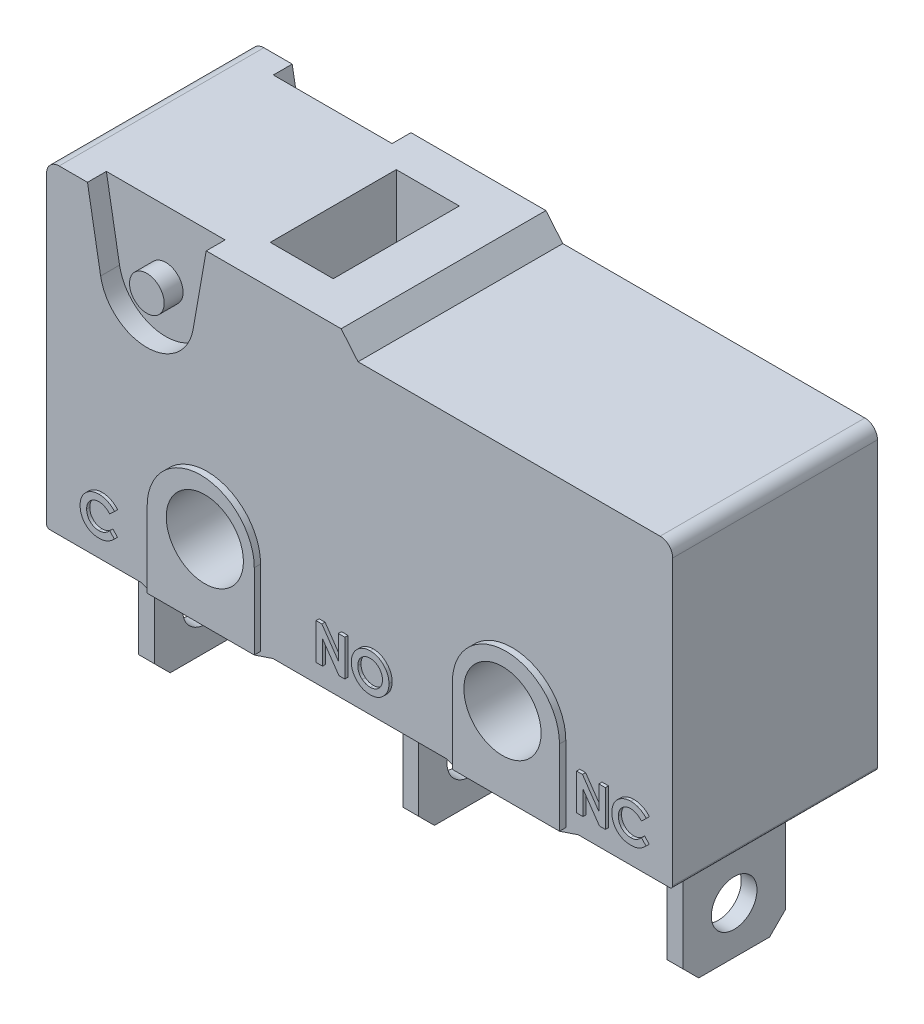
from build123d import *

# Parameters (mm, degrees)
BOSS_EXTRUDE1_DEPTH = 6.5
BOSS_EXTRUDE2_DEPTH = 0.2
SKETCH4_R           = 1.225
CUT_EXTRUDE1_DEPTH  = 10.2
FILLET1_R           = 0.1
SKETCH5_R           = 0.55
CUT_EXTRUDE2_DEPTH  = 0.6
SKETCH6_W           = 2
SKETCH6_H           = 4
CUT_EXTRUDE3_DEPTH  = 2
SKETCH7_W           = 0.5
SKETCH7_H           = 3.25
BOSS_EXTRUDE3_DEPTH = 4.15
CHAMFER1_SIZE       = 0.5
SKETCH8_R           = 0.725
CUT_EXTRUDE4_DEPTH  = 18.15
BOSS_EXTRUDE4_DEPTH = 0.1
BOSS_EXTRUDE5_DEPTH = 0.1
BOSS_EXTRUDE6_DEPTH = 0.1
BOSS_EXTRUDE7_DEPTH = 0.1
BOSS_EXTRUDE8_DEPTH = 0.1
BOSS_EXTRUDE9_DEPTH = 0.1


with BuildPart() as part:
    # Sketch1 → Boss-Extrude1 (new body)
    with BuildSketch(Plane.XY):
        with BuildLine():
            Line((9.352976236, 0), (9.89, -0.64))
            Line((9.89, -0.64), (19.48, -0.64))
            ThreePointArc((19.48, -0.64), (19.762842712, -0.757157288), (19.88, -1.04))
            Line((19.88, -1.04), (19.88, -10.15))
            Line((19.88, -10.15), (16.88, -10.15))
            Line((16.88, -10.15), (16.285, -10.35))
            Line((16.285, -10.35), (13.285, -10.35))
            Line((13.285, -10.35), (12.69, -10.15))
            Line((12.69, -10.15), (7.19, -10.15))
            Line((7.19, -10.15), (6.595, -10.35))
            Line((6.595, -10.35), (3.595, -10.35))
            Line((3.595, -10.35), (3, -10.15))
            Line((3, -10.15), (0, -10.15))
            Line((0, -10.15), (0, -0.4))
            ThreePointArc((0, -0.4), (0.117157288, -0.117157288), (0.4, 0))
            Line((0.4, 0), (9.352976236, 0))
        make_face()
    extrude(amount=BOSS_EXTRUDE1_DEPTH)

    # Sketch3 → Boss-Extrude2 (add)
    with BuildSketch(Plane.XY.offset(6.5)):
        with BuildLine():
            Line((3.395, -7.75), (3.395, -10.15))
            Line((3.395, -10.15), (6.795, -10.15))
            Line((6.795, -10.15), (6.795, -7.75))
            ThreePointArc((6.795, -7.75), (5.095, -6.05), (3.395, -7.75))
        make_face()
        with BuildLine():
            Line((13.085, -7.75), (13.085, -10.15))
            Line((13.085, -10.15), (16.485, -10.15))
            Line((16.485, -10.15), (16.485, -7.75))
            ThreePointArc((16.485, -7.75), (14.785, -6.05), (13.085, -7.75))
        make_face()
    boss_extrude2 = extrude(amount=BOSS_EXTRUDE2_DEPTH)

    # Mirror1: Boss-Extrude2 across plane
    add(boss_extrude2.mirror(Plane.XY.offset(3.25)))

    # Sketch4 → Cut-Extrude1 (cut)
    with BuildSketch(Plane.XY.offset(6.7)):
        with Locations((5.225191111, -7.750594536)):
            Circle(SKETCH4_R)
        with Locations((14.675191092, -7.750006829)):
            Circle(SKETCH4_R)
    extrude(amount=-CUT_EXTRUDE1_DEPTH, mode=Mode.SUBTRACT)

    # Fillet1
    fillet1_edges = [part.edges().sort_by_distance(p)[0] for p in [
        (0, -10.15, 3.25),
        (19.88, -10.15, 3.25),
    ]]
    fillet(fillet1_edges, radius=FILLET1_R)

    # Sketch5 → Cut-Extrude2 (cut)
    with BuildSketch(Plane.XY.offset(6.5)):
        with BuildLine():
            Line((1.717678208, -2.368770825), (1.3, 0))
            Line((1.3, 0), (5.07, 0))
            Line((5.07, 0), (4.652321792, -2.368770825))
            ThreePointArc((4.652321792, -2.368770825), (3.185, -3.6), (1.717678208, -2.368770825))
        make_face()
        with Locations((3.185, -2.110042404)):
            Circle(SKETCH5_R, mode=Mode.SUBTRACT)
    cut_extrude2 = extrude(amount=-CUT_EXTRUDE2_DEPTH, mode=Mode.SUBTRACT)

    # Mirror2: Cut-Extrude2 across plane
    add(cut_extrude2.mirror(Plane.XY.offset(3.25)), mode=Mode.SUBTRACT)

    # Sketch6 → Cut-Extrude3 (cut)
    with BuildSketch(Plane(origin=(0, 0, 0), x_dir=(1, 0, 0), z_dir=(0, 1, 0))):
        with Locations((6.852976236, -3.25)):
            Rectangle(SKETCH6_W, SKETCH6_H)
    extrude(amount=-CUT_EXTRUDE3_DEPTH, mode=Mode.SUBTRACT)

    # Sketch7 → Boss-Extrude3 (add)
    with BuildSketch(Plane.XZ.offset(10.15)):
        with Locations((1.55, 3.25)):
            Rectangle(SKETCH7_W, SKETCH7_H)
        with Locations((9.94, 3.25)):
            Rectangle(SKETCH7_W, SKETCH7_H)
        with Locations((18.33, 3.25)):
            Rectangle(SKETCH7_W, SKETCH7_H)
    extrude(amount=BOSS_EXTRUDE3_DEPTH)

    # Chamfer1
    chamfer1_edges = [part.edges().sort_by_distance(p)[0] for p in [
        (1.55, -14.3, 1.625),
        (1.55, -14.3, 4.875),
        (9.94, -14.3, 1.625),
        (9.94, -14.3, 4.875),
        (18.33, -14.3, 1.625),
        (18.33, -14.3, 4.875),
    ]]
    chamfer(chamfer1_edges, length=CHAMFER1_SIZE)

    # Sketch8 → Cut-Extrude4 (cut)
    with BuildSketch(Plane.ZY.offset(-1.3)):
        with Locations((3.25, -12.8)):
            Circle(SKETCH8_R)
    extrude(amount=-CUT_EXTRUDE4_DEPTH, mode=Mode.SUBTRACT)

    # Sketch9 → Boss-Extrude4 (add)
    # profile 1 of 5: a face of its own
    with BuildSketch(Plane.XY.offset(6.5)):
        with BuildLine():
            Line((2.257577475, -8.522307291), (2.106225312, -8.666978765))
            add(Edge.make_bspline(
                [(2.106225312, -8.666978765), (2.093386388, -8.653703296), (2.068307948, -8.627772147), (2.027897144, -8.593441591), (1.985871379, -8.564831718), (1.94304818, -8.540736665), (1.898657283, -8.52250704), (1.853211966, -8.509222805), (1.806422049, -8.501123909), (1.774756433, -8.500197252), (1.758829479, -8.499731169)],
                knots=[0, 0, 0, 0, 1.115251505, 2.178435587, 3.19620269, 4.182487026, 5.141301733, 6.088180966, 7.038406374, 8, 8, 8, 8], degree=3))
            add(Edge.make_bspline(
                [(1.758829479, -8.499731169), (1.745528536, -8.500099391), (1.719280592, -8.500826037), (1.680741731, -8.506153071), (1.643877319, -8.515211923), (1.608561163, -8.527696699), (1.574897182, -8.543851336), (1.542814796, -8.563663332), (1.512393102, -8.586953756), (1.484033954, -8.613602102), (1.458092001, -8.642717422), (1.435170634, -8.6737834), (1.415970313, -8.706728863), (1.400212921, -8.741220166), (1.387938523, -8.777416951), (1.37917306, -8.815294849), (1.37410335, -8.85489897), (1.373346662, -8.881821556), (1.372962091, -8.895504406)],
                knots=[0, 0, 0, 0, 1.035432265, 2.043311493, 3.022114605, 3.98653278, 4.95457646, 5.923598177, 6.917315552, 7.932509744, 8.948865224, 9.949768934, 10.933144597, 11.912367597, 12.897413939, 13.903909035, 14.934704909, 16, 16, 16, 16], degree=3))
            add(Edge.make_bspline(
                [(1.372962091, -8.895504406), (1.37307292, -8.905107988), (1.373291366, -8.924036844), (1.375682647, -8.952037877), (1.379533173, -8.979205498), (1.385105838, -9.005498556), (1.392074511, -9.030939838), (1.400250351, -9.055748822), (1.410506821, -9.079582706), (1.421891658, -9.102718305), (1.435132093, -9.124524334), (1.449407724, -9.145318192), (1.464887315, -9.16499795), (1.481671128, -9.183483157), (1.499995375, -9.20048493), (1.519386441, -9.216514532), (1.540171427, -9.231170689), (1.561918577, -9.244821213), (1.584815758, -9.256679539), (1.608241716, -9.267420892), (1.632551637, -9.276144467), (1.657449532, -9.283176464), (1.682846425, -9.289156128), (1.708990721, -9.292837991), (1.735655782, -9.295626222), (1.753676888, -9.295798379), (1.762745745, -9.295885015)],
                knots=[0, 0, 0, 0, 1.103660481, 2.175337485, 3.227646561, 4.255952547, 5.262355991, 6.258840057, 7.255597736, 8.242457506, 9.22035537, 10.185017736, 11.140346927, 12.096287581, 13.051739095, 14.01125915, 14.986044842, 15.97314143, 16.960198552, 17.947847494, 18.933482797, 19.925264591, 20.920966487, 21.929612487, 22.958107872, 24, 24, 24, 24], degree=3))
            add(Edge.make_bspline(
                [(1.762745745, -9.295885015), (1.778128085, -9.295440076), (1.808350382, -9.294565887), (1.85270595, -9.287729851), (1.894972387, -9.276484958), (1.928743068, -9.263205394), (1.955201504, -9.250091651), (1.975343921, -9.237962085), (1.996172749, -9.224393834), (2.017342041, -9.208874817), (2.039089908, -9.191591269), (2.061032451, -9.172164647), (2.083731402, -9.151234643), (2.09860126, -9.136296487), (2.106225312, -9.128637419)],
                knots=[0, 0, 0, 0, 1.404581149, 2.759636711, 4.088442092, 5.392261763, 6.066678138, 6.783632037, 7.538459478, 8.336747902, 9.180226004, 10.074962426, 11.012997595, 12, 12, 12, 12], degree=3))
            Line((2.106225312, -9.128637419), (2.252970104, -9.282754005))
            add(Edge.make_bspline(
                [(2.252970104, -9.282754005), (2.242654735, -9.29271317), (2.22252134, -9.31215133), (2.192150674, -9.339751704), (2.16181823, -9.364553707), (2.132256778, -9.387457546), (2.10298207, -9.407795974), (2.07399721, -9.425589304), (2.04563032, -9.441287555), (2.017292352, -9.454625984), (1.988806972, -9.465951696), (1.959498864, -9.475702391), (1.92927843, -9.483951127), (1.897961098, -9.490606774), (1.865838975, -9.495943705), (1.832611442, -9.499546102), (1.798489178, -9.501967874), (1.775343518, -9.50218549), (1.763667219, -9.502295271)],
                knots=[0, 0, 0, 0, 1.244526981, 2.429050516, 3.560637417, 4.644440555, 5.67424972, 6.652764056, 7.595344123, 8.486817594, 9.369275933, 10.254498637, 11.166417451, 12.086725134, 13.032340136, 13.991389299, 14.986715468, 16, 16, 16, 16], degree=3))
            add(Edge.make_bspline(
                [(1.763667219, -9.502295271), (1.742219304, -9.501748521), (1.700251695, -9.500678683), (1.638749259, -9.492751908), (1.580323596, -9.479462808), (1.524832567, -9.460668356), (1.472293817, -9.436659324), (1.422720786, -9.407225379), (1.376193377, -9.372444721), (1.333087437, -9.332725014), (1.294096064, -9.288857931), (1.259632205, -9.24175672), (1.2311237, -9.191189893), (1.207452473, -9.137904485), (1.188941886, -9.081657334), (1.17591357, -9.022387598), (1.167879103, -8.960152504), (1.167000121, -8.917644501), (1.166551834, -8.895965143)],
                knots=[0, 0, 0, 0, 1.078019885, 2.10938526, 3.111377082, 4.085535484, 5.04941344, 6.010039228, 6.978205633, 7.964457913, 8.951525778, 9.924444315, 10.892603023, 11.863865945, 12.85144698, 13.863884204, 14.910567087, 16, 16, 16, 16], degree=3))
            add(Edge.make_bspline(
                [(1.166551834, -8.895965143), (1.166741259, -8.881826051), (1.167116651, -8.853805826), (1.17106206, -8.812529765), (1.17656219, -8.772292989), (1.185287646, -8.733513288), (1.195805323, -8.695668229), (1.208885436, -8.659169144), (1.224507094, -8.623911129), (1.242166775, -8.589835162), (1.262144995, -8.557164476), (1.28446286, -8.526179764), (1.308545821, -8.496641829), (1.334972553, -8.468942548), (1.36335904, -8.442838715), (1.393833444, -8.418471792), (1.426212477, -8.395492329), (1.460583776, -8.374492912), (1.4962796, -8.355497823), (1.532849729, -8.338743343), (1.570204316, -8.324740456), (1.608185421, -8.313125578), (1.646953515, -8.304455893), (1.68623188, -8.297893221), (1.726354728, -8.294224645), (1.753293744, -8.293624076), (1.766892379, -8.293320912)],
                knots=[0, 0, 0, 0, 1.071919942, 2.124283339, 3.142214191, 4.149696895, 5.136002878, 6.119640489, 7.086990633, 8.058538607, 9.028339693, 9.988281803, 10.952401235, 11.916291999, 12.888973767, 13.874849856, 14.873389453, 15.898127285, 16.927174885, 17.938320013, 18.946391617, 19.950418109, 20.947802303, 21.956882652, 22.968648068, 24, 24, 24, 24], degree=3))
            add(Edge.make_bspline(
                [(1.766892379, -8.293320912), (1.778493409, -8.293494693), (1.80157485, -8.293840448), (1.83594699, -8.29672269), (1.870044237, -8.301249221), (1.903744513, -8.308078794), (1.937288877, -8.316186359), (1.970236519, -8.326802098), (2.003107205, -8.338635339), (2.035385407, -8.352779563), (2.067116181, -8.368219261), (2.097556184, -8.385736159), (2.1272165, -8.404252286), (2.155439875, -8.424863509), (2.182754994, -8.44682222), (2.209019022, -8.470230868), (2.234001478, -8.495479745), (2.249679081, -8.513319567), (2.257577475, -8.522307291)],
                knots=[0, 0, 0, 0, 0.996412454, 1.982464992, 2.961075852, 3.949442424, 4.934965278, 5.923860011, 6.921385422, 7.934793307, 8.949617135, 9.951082467, 10.950285876, 11.951772932, 12.951063433, 13.960125323, 14.972308753, 16, 16, 16, 16], degree=3))
        make_face()
    # profile 2 of 5: a face of its own
    with BuildSketch(Plane.XY.offset(6.5)):
        Polygon((8.656295424, -8.322808092), (8.842202876, -8.322808092), (9.363987732, -9.079568909), (9.363987732, -8.322808092), (9.570397988, -8.322808092), (9.570397988, -9.472808092), (9.383108325, -9.472808092), (8.862705681, -8.71835096), (8.862705681, -9.472808092), (8.656295424, -9.472808092), align=None)
    # profile 3 of 5: a face of its own
    with BuildSketch(Plane.XY.offset(6.5)):
        with BuildLine():
            add(Edge.make_bspline(
                [(10.376227315, -8.293320912), (10.396221475, -8.293838597), (10.435694474, -8.294860624), (10.493745011, -8.303380013), (10.549687438, -8.317261137), (10.603496456, -8.336556904), (10.655037335, -8.36178994), (10.704491876, -8.392244873), (10.751682935, -8.428496522), (10.796126936, -8.469699194), (10.837201209, -8.514505302), (10.872792091, -8.562747042), (10.903142689, -8.613174423), (10.928297346, -8.665922568), (10.947457299, -8.721356781), (10.960902631, -8.779194422), (10.96954059, -8.839419036), (10.970534089, -8.880423789), (10.971039014, -8.901263621)],
                knots=[0, 0, 0, 0, 1.014329547, 2.002516266, 2.970391464, 3.935626869, 4.897733899, 5.877609409, 6.878433252, 7.912639331, 8.949961323, 9.958554974, 10.949718813, 11.932905612, 12.9188844, 13.919928257, 14.942845884, 16, 16, 16, 16], degree=3))
            add(Edge.make_bspline(
                [(10.971039014, -8.901263621), (10.97050129, -8.921868635), (10.969441689, -8.962471477), (10.96125527, -9.022141098), (10.947583517, -9.079359177), (10.928748532, -9.134255229), (10.904050085, -9.186563356), (10.874291357, -9.236617539), (10.83868707, -9.283953263), (10.798535854, -9.328545125), (10.754332849, -9.369021808), (10.70751485, -9.404691815), (10.658298033, -9.434917233), (10.606754435, -9.459684217), (10.552773525, -9.478904961), (10.496488642, -9.492466593), (10.437903268, -9.500708271), (10.398062372, -9.501760951), (10.377839895, -9.502295271)],
                knots=[0, 0, 0, 0, 1.051557043, 2.072126891, 3.067553643, 4.050577992, 5.02905126, 6.015227836, 7.017913613, 8.04756643, 9.074058332, 10.072836633, 11.047628519, 12.017157415, 12.98668631, 13.966869689, 14.968021931, 16, 16, 16, 16], degree=3))
            add(Edge.make_bspline(
                [(10.377839895, -9.502295271), (10.356689609, -9.50181596), (10.315132189, -9.500874178), (10.254312717, -9.49191826), (10.196042409, -9.47842752), (10.140810767, -9.458293315), (10.088055304, -9.433123865), (10.038163631, -9.402126179), (9.991152515, -9.365351481), (9.947291618, -9.323741587), (9.907553539, -9.278211237), (9.87247689, -9.230112459), (9.842888959, -9.179812686), (9.818788662, -9.127288378), (9.799788956, -9.072865958), (9.786386823, -9.01621398), (9.778469862, -8.957468316), (9.777367076, -8.917567086), (9.776808245, -8.897347355)],
                knots=[0, 0, 0, 0, 1.067978421, 2.098431617, 3.099715153, 4.085208694, 5.062210972, 6.048429807, 7.046490867, 8.072918869, 9.098532598, 10.095778865, 11.076610158, 12.041847152, 13.011192615, 13.984257998, 14.978533688, 16, 16, 16, 16], degree=3))
            add(Edge.make_bspline(
                [(9.776808245, -8.897347355), (9.776983638, -8.883744578), (9.777332204, -8.856711267), (9.781531048, -8.816649279), (9.787576175, -8.777369248), (9.796516632, -8.739027783), (9.807377002, -8.701354403), (9.821448145, -8.664699782), (9.837464914, -8.628672346), (9.856179001, -8.593697626), (9.876987255, -8.560097417), (9.899690914, -8.528030218), (9.924347065, -8.497883769), (9.950876281, -8.469459958), (9.979369987, -8.442945619), (10.009453378, -8.417965403), (10.041709895, -8.395182874), (10.075433545, -8.374041637), (10.110434202, -8.354923983), (10.146569381, -8.338651607), (10.183094626, -8.324441219), (10.220497866, -8.313225752), (10.258378257, -8.304090872), (10.297140476, -8.298049819), (10.336434327, -8.293851092), (10.362931507, -8.293498058), (10.376227315, -8.293320912)],
                knots=[0, 0, 0, 0, 1.034744296, 2.056386356, 3.06226378, 4.057406941, 5.050368692, 6.043467995, 7.042652155, 8.049140477, 9.059438543, 10.048523776, 11.036952808, 12.020949711, 13.004946614, 13.997082645, 14.994316842, 16.007702937, 17.024872941, 18.026463647, 19.021641123, 20.005082605, 20.995858141, 21.984425357, 22.988620895, 24, 24, 24, 24], degree=3))
        make_face()
        with BuildLine():
            add(Edge.make_bspline(
                [(10.373002155, -8.499731169), (10.359546088, -8.500092225), (10.332989197, -8.500804806), (10.294035075, -8.50623371), (10.256637742, -8.514904286), (10.221004506, -8.527463509), (10.18698093, -8.543448213), (10.154506701, -8.562802545), (10.124031519, -8.586191788), (10.095149028, -8.612360278), (10.069058449, -8.64151799), (10.0460066, -8.672765438), (10.026715916, -8.706050438), (10.010559847, -8.74106378), (9.998397907, -8.778199182), (9.989735322, -8.817165756), (9.984260892, -8.858030644), (9.983570833, -8.885888185), (9.983218501, -8.900111778)],
                knots=[0, 0, 0, 0, 1.033739768, 2.040188636, 3.016340934, 3.979330865, 4.937572243, 5.900995986, 6.878200029, 7.884839167, 8.891893314, 9.879764717, 10.863503415, 11.843163062, 12.837761627, 13.859916423, 14.907309254, 16, 16, 16, 16], degree=3))
            add(Edge.make_bspline(
                [(9.983218501, -8.900111778), (9.98368564, -8.915874718), (9.984601155, -8.946767469), (9.99104283, -8.991832983), (10.002063894, -9.034392887), (10.017978097, -9.074239029), (10.037715884, -9.11181387), (10.062227082, -9.146656876), (10.091114727, -9.178976671), (10.113369534, -9.197846314), (10.124664815, -9.207423476)],
                knots=[0, 0, 0, 0, 1.078454662, 2.113592447, 3.107694534, 4.079536787, 5.043276885, 6.005368276, 6.987637804, 8, 8, 8, 8], degree=3))
            add(Edge.make_bspline(
                [(10.124664815, -9.207423476), (10.133917807, -9.214498717), (10.152215318, -9.22848979), (10.18142213, -9.246422222), (10.211499396, -9.261792104), (10.242674085, -9.274210787), (10.274880359, -9.283979115), (10.308113801, -9.290819714), (10.342327323, -9.295112782), (10.365464109, -9.295625885), (10.37714879, -9.295885015)],
                knots=[0, 0, 0, 0, 1.023928204, 2.024787132, 3.009472467, 3.9914905, 4.972207045, 5.96565515, 6.972602802, 8, 8, 8, 8], degree=3))
            add(Edge.make_bspline(
                [(10.37714879, -9.295885015), (10.390373479, -9.295520897), (10.416393471, -9.294804484), (10.454622441, -9.289442413), (10.491246956, -9.280367853), (10.526494383, -9.267918804), (10.560263085, -9.251733398), (10.592388025, -9.231778756), (10.622925526, -9.208299894), (10.651771221, -9.181787754), (10.67813755, -9.152515181), (10.701141295, -9.121101063), (10.721045327, -9.088237547), (10.73686543, -9.0534595), (10.74950786, -9.017095211), (10.758066187, -8.978983631), (10.763586863, -8.939281868), (10.764277116, -8.912263416), (10.764628757, -8.898499198)],
                knots=[0, 0, 0, 0, 1.026359118, 2.019393844, 2.989460624, 3.950973911, 4.916101784, 5.890408035, 6.881132271, 7.902007068, 8.92769091, 9.933912415, 10.920395702, 11.90457117, 12.894218921, 13.903490204, 14.931958862, 16, 16, 16, 16], degree=3))
            add(Edge.make_bspline(
                [(10.764628757, -8.898499198), (10.76426495, -8.884814127), (10.763548849, -8.857877154), (10.758177341, -8.818277464), (10.74916033, -8.780334135), (10.736673897, -8.7439852), (10.720729384, -8.709195024), (10.701012376, -8.676085951), (10.677592058, -8.644689987), (10.651007446, -8.615221086), (10.62207173, -8.588141053), (10.591006348, -8.564640507), (10.558680544, -8.54421928), (10.524352606, -8.528222115), (10.488724855, -8.515477208), (10.451579888, -8.506091675), (10.412777018, -8.500842945), (10.386378623, -8.500105064), (10.373002155, -8.499731169)],
                knots=[0, 0, 0, 0, 1.055025985, 2.07665775, 3.074803781, 4.057872707, 5.035505728, 6.020516407, 7.023567878, 8.050795229, 9.077271434, 10.074415901, 11.050397877, 12.019801805, 12.988065821, 13.964604439, 14.968634123, 16, 16, 16, 16], degree=3))
        make_face(mode=Mode.SUBTRACT)
    # profile 4 of 5: a face of its own
    with BuildSketch(Plane.XY.offset(6.5)):
        Polygon((16.92744927, -8.322808092), (17.113356722, -8.322808092), (17.635141578, -9.079568909), (17.635141578, -8.322808092), (17.841551834, -8.322808092), (17.841551834, -9.472808092), (17.654262171, -9.472808092), (17.133859527, -8.71835096), (17.133859527, -9.472808092), (16.92744927, -9.472808092), align=None)
    # profile 5 of 5: a face of its own
    with BuildSketch(Plane.XY.offset(6.5)):
        with BuildLine():
            Line((19.138987732, -8.522307291), (18.987635568, -8.666978765))
            add(Edge.make_bspline(
                [(18.987635568, -8.666978765), (18.974796645, -8.653703296), (18.949718205, -8.627772147), (18.9093074, -8.593441591), (18.867281635, -8.564831718), (18.824458436, -8.540736665), (18.780067539, -8.52250704), (18.734622223, -8.509222805), (18.687832306, -8.501123909), (18.656166689, -8.500197252), (18.640239735, -8.499731169)],
                knots=[0, 0, 0, 0, 1.115251505, 2.178435587, 3.19620269, 4.182487026, 5.141301733, 6.088180966, 7.038406374, 8, 8, 8, 8], degree=3))
            add(Edge.make_bspline(
                [(18.640239735, -8.499731169), (18.626938793, -8.500099391), (18.600690848, -8.500826037), (18.562151987, -8.506153071), (18.525287575, -8.515211923), (18.489971419, -8.527696699), (18.456307438, -8.543851336), (18.424225052, -8.563663332), (18.393803358, -8.586953756), (18.36544421, -8.613602102), (18.339502258, -8.642717422), (18.316580891, -8.6737834), (18.297380569, -8.706728863), (18.281623178, -8.741220166), (18.269348779, -8.777416951), (18.260583316, -8.815294849), (18.255513606, -8.85489897), (18.254756918, -8.881821556), (18.254372347, -8.895504406)],
                knots=[0, 0, 0, 0, 1.035432265, 2.043311493, 3.022114605, 3.98653278, 4.95457646, 5.923598177, 6.917315552, 7.932509744, 8.948865224, 9.949768934, 10.933144597, 11.912367597, 12.897413939, 13.903909035, 14.934704909, 16, 16, 16, 16], degree=3))
            add(Edge.make_bspline(
                [(18.254372347, -8.895504406), (18.254483176, -8.905107988), (18.254701623, -8.924036844), (18.257092903, -8.952037877), (18.260943429, -8.979205498), (18.266516095, -9.005498556), (18.273484767, -9.030939838), (18.281660607, -9.055748822), (18.291917078, -9.079582706), (18.303301915, -9.102718305), (18.316542349, -9.124524334), (18.33081798, -9.145318192), (18.346297571, -9.16499795), (18.363081384, -9.183483157), (18.381405631, -9.20048493), (18.400796697, -9.216514532), (18.421581684, -9.231170689), (18.443328834, -9.244821213), (18.466226014, -9.256679539), (18.489651973, -9.267420892), (18.513961893, -9.276144467), (18.538859788, -9.283176464), (18.564256681, -9.289156128), (18.590400977, -9.292837991), (18.617066039, -9.295626222), (18.635087144, -9.295798379), (18.644156001, -9.295885015)],
                knots=[0, 0, 0, 0, 1.103660481, 2.175337485, 3.227646561, 4.255952547, 5.262355991, 6.258840057, 7.255597736, 8.242457506, 9.22035537, 10.185017736, 11.140346927, 12.096287581, 13.051739095, 14.01125915, 14.986044842, 15.97314143, 16.960198552, 17.947847494, 18.933482797, 19.925264591, 20.920966487, 21.929612487, 22.958107872, 24, 24, 24, 24], degree=3))
            add(Edge.make_bspline(
                [(18.644156001, -9.295885015), (18.659538341, -9.295440076), (18.689760639, -9.294565887), (18.734116206, -9.287729851), (18.776382643, -9.276484958), (18.810153324, -9.263205394), (18.836611761, -9.250091651), (18.856754177, -9.237962085), (18.877583006, -9.224393834), (18.898752298, -9.208874817), (18.920500165, -9.191591269), (18.942442708, -9.172164647), (18.965141659, -9.151234643), (18.980011517, -9.136296487), (18.987635568, -9.128637419)],
                knots=[0, 0, 0, 0, 1.404581149, 2.759636711, 4.088442092, 5.392261763, 6.066678138, 6.783632037, 7.538459478, 8.336747902, 9.180226004, 10.074962426, 11.012997595, 12, 12, 12, 12], degree=3))
            Line((18.987635568, -9.128637419), (19.13438036, -9.282754005))
            add(Edge.make_bspline(
                [(19.13438036, -9.282754005), (19.124064991, -9.29271317), (19.103931597, -9.31215133), (19.07356093, -9.339751704), (19.043228487, -9.364553707), (19.013667035, -9.387457546), (18.984392326, -9.407795974), (18.955407466, -9.425589304), (18.927040576, -9.441287555), (18.898702608, -9.454625984), (18.870217229, -9.465951696), (18.840909121, -9.475702391), (18.810688687, -9.483951127), (18.779371354, -9.490606774), (18.747249232, -9.495943705), (18.714021699, -9.499546102), (18.679899435, -9.501967874), (18.656753775, -9.50218549), (18.645077475, -9.502295271)],
                knots=[0, 0, 0, 0, 1.244526981, 2.429050516, 3.560637417, 4.644440555, 5.67424972, 6.652764056, 7.595344123, 8.486817594, 9.369275933, 10.254498637, 11.166417451, 12.086725134, 13.032340136, 13.991389299, 14.986715468, 16, 16, 16, 16], degree=3))
            add(Edge.make_bspline(
                [(18.645077475, -9.502295271), (18.62362956, -9.501748521), (18.581661952, -9.500678683), (18.520159516, -9.492751908), (18.461733853, -9.479462808), (18.406242823, -9.460668356), (18.353704073, -9.436659324), (18.304131043, -9.407225379), (18.257603633, -9.372444721), (18.214497694, -9.332725014), (18.17550632, -9.288857931), (18.141042461, -9.24175672), (18.112533956, -9.191189893), (18.08886273, -9.137904485), (18.070352142, -9.081657334), (18.057323827, -9.022387598), (18.04928936, -8.960152504), (18.048410377, -8.917644501), (18.047962091, -8.895965143)],
                knots=[0, 0, 0, 0, 1.078019885, 2.10938526, 3.111377082, 4.085535484, 5.04941344, 6.010039228, 6.978205633, 7.964457913, 8.951525778, 9.924444315, 10.892603023, 11.863865945, 12.85144698, 13.863884204, 14.910567087, 16, 16, 16, 16], degree=3))
            add(Edge.make_bspline(
                [(18.047962091, -8.895965143), (18.048151515, -8.881826051), (18.048526907, -8.853805826), (18.052472317, -8.812529765), (18.057972447, -8.772292989), (18.066697903, -8.733513288), (18.077215579, -8.695668229), (18.090295692, -8.659169144), (18.10591735, -8.623911129), (18.123577031, -8.589835162), (18.143555251, -8.557164476), (18.165873116, -8.526179764), (18.189956078, -8.496641829), (18.216382809, -8.468942548), (18.244769296, -8.442838715), (18.2752437, -8.418471792), (18.307622733, -8.395492329), (18.341994033, -8.374492912), (18.377689856, -8.355497823), (18.414259986, -8.338743343), (18.451614572, -8.324740456), (18.489595677, -8.313125578), (18.528363771, -8.304455893), (18.567642136, -8.297893221), (18.607764984, -8.294224645), (18.634704001, -8.293624076), (18.648302636, -8.293320912)],
                knots=[0, 0, 0, 0, 1.071919942, 2.124283339, 3.142214191, 4.149696895, 5.136002878, 6.119640489, 7.086990633, 8.058538607, 9.028339693, 9.988281803, 10.952401235, 11.916291999, 12.888973767, 13.874849856, 14.873389453, 15.898127285, 16.927174885, 17.938320013, 18.946391617, 19.950418109, 20.947802303, 21.956882652, 22.968648068, 24, 24, 24, 24], degree=3))
            add(Edge.make_bspline(
                [(18.648302636, -8.293320912), (18.659903666, -8.293494693), (18.682985107, -8.293840448), (18.717357246, -8.29672269), (18.751454493, -8.301249221), (18.78515477, -8.308078794), (18.818699134, -8.316186359), (18.851646775, -8.326802098), (18.884517461, -8.338635339), (18.916795663, -8.352779563), (18.948526438, -8.368219261), (18.97896644, -8.385736159), (19.008626757, -8.404252286), (19.036850132, -8.424863509), (19.06416525, -8.44682222), (19.090429279, -8.470230868), (19.115411735, -8.495479745), (19.131089337, -8.513319567), (19.138987732, -8.522307291)],
                knots=[0, 0, 0, 0, 0.996412454, 1.982464992, 2.961075852, 3.949442424, 4.934965278, 5.923860011, 6.921385422, 7.934793307, 8.949617135, 9.951082467, 10.950285876, 11.951772932, 12.951063433, 13.960125323, 14.972308753, 16, 16, 16, 16], degree=3))
        make_face()
    extrude(amount=BOSS_EXTRUDE4_DEPTH)

    # Sketch11 → Boss-Extrude5 (add)
    with BuildSketch(Plane(origin=(0, 0, 0), x_dir=(-1, 0, 0), z_dir=(0, 0, -1))):
        Polygon((-18.832232526, -0.929337472), (-18.672488937, -0.929337472), (-18.672488937, -1.607178016), (-17.930465699, -0.929337472), (-17.702617142, -0.929337472), (-18.57728461, -1.72805542), (-17.634155603, -2.709337472), (-17.847028199, -2.709337472), (-18.672488937, -1.850359106), (-18.672488937, -2.709337472), (-18.832232526, -2.709337472), align=None)
        Polygon((-17.48582227, -0.929337472), (-17.320730122, -0.929337472), (-16.972360731, -2.234742119), (-16.454263776, -0.929337472), (-16.431086693, -0.929337472), (-15.922617142, -2.225827856), (-15.572464898, -0.929337472), (-15.409155603, -0.929337472), (-15.889099514, -2.709337472), (-15.911920026, -2.709337472), (-16.447488937, -1.347951254), (-16.989476116, -2.709337472), (-17.012296629, -2.709337472), align=None)
        with BuildLine():
            Line((-8.654283808, -1.255956061), (-8.794059449, -1.362927215))
            add(Edge.make_bspline(
                [(-8.794059449, -1.362927215), (-8.804030444, -1.351043951), (-8.823838003, -1.327437633), (-8.855704683, -1.294289179), (-8.888915233, -1.263233132), (-8.923456957, -1.234121548), (-8.959951595, -1.20797245), (-8.997515087, -1.183423146), (-9.036775807, -1.161418411), (-9.091066689, -1.134737235), (-9.162087595, -1.106894904), (-9.251491827, -1.083549833), (-9.344820329, -1.068688777), (-9.408492251, -1.06707923), (-9.44087836, -1.066260548)],
                knots=[0, 0, 0, 0, 0.757959112, 1.505699292, 2.245454638, 2.979532153, 3.711538275, 4.438200793, 5.171680507, 5.909471876, 7.393775596, 8.890124382, 10.418191784, 12, 12, 12, 12], degree=3))
            add(Edge.make_bspline(
                [(-9.44087836, -1.066260548), (-9.458720723, -1.066465992), (-9.494239857, -1.066874973), (-9.546952509, -1.072270471), (-9.598680861, -1.079853887), (-9.649391263, -1.091106194), (-9.699019168, -1.105332269), (-9.747889018, -1.122331479), (-9.795293266, -1.143363369), (-9.841887684, -1.166609284), (-9.886529683, -1.192865527), (-9.928769108, -1.221504889), (-9.968451903, -1.252206887), (-10.00560946, -1.285086592), (-10.040279765, -1.319995932), (-10.072211597, -1.35730694), (-10.101294463, -1.396900331), (-10.128104836, -1.438254007), (-10.152115883, -1.481247513), (-10.17221965, -1.526039977), (-10.190022255, -1.57186435), (-10.204109299, -1.619238368), (-10.215259481, -1.667828689), (-10.222952979, -1.717765719), (-10.228287116, -1.768945133), (-10.228694063, -1.80363444), (-10.228899193, -1.821120324)],
                knots=[0, 0, 0, 0, 1.054917814, 2.100044995, 3.131103042, 4.146048494, 5.169673617, 6.183595914, 7.203665975, 8.234915748, 9.262203917, 10.264457458, 11.251630812, 12.227803204, 13.197192746, 14.159520551, 15.12972552, 16.100847026, 17.073214652, 18.039054194, 19.002613845, 19.979014051, 20.95965708, 21.949030935, 22.966165397, 24, 24, 24, 24], degree=3))
            add(Edge.make_bspline(
                [(-10.228899193, -1.821120324), (-10.228257468, -1.847429395), (-10.226997526, -1.899083767), (-10.215784373, -1.974744249), (-10.198744641, -2.047226192), (-10.173206433, -2.116076512), (-10.141716173, -2.182144191), (-10.101925234, -2.244311379), (-10.055840252, -2.303517518), (-10.002809261, -2.35836336), (-9.944625732, -2.408464626), (-9.882199651, -2.452583493), (-9.815686499, -2.489360776), (-9.74582067, -2.519964543), (-9.672064532, -2.543489393), (-9.594550718, -2.560050576), (-9.513447818, -2.570853742), (-9.458029095, -2.571888018), (-9.429824674, -2.572414395)],
                knots=[0, 0, 0, 0, 1.029171465, 2.020641659, 2.987623507, 3.938342917, 4.889210282, 5.84687017, 6.821220943, 7.821438502, 8.827599549, 9.822697543, 10.807740252, 11.797342354, 12.80366471, 13.83203677, 14.896651826, 16, 16, 16, 16], degree=3))
            add(Edge.make_bspline(
                [(-9.429824674, -2.572414395), (-9.398749592, -2.57155553), (-9.337586397, -2.569865077), (-9.247890658, -2.555544088), (-9.162025611, -2.532323775), (-9.079986639, -2.499827118), (-9.002005019, -2.457582486), (-8.927958717, -2.406370422), (-8.857785233, -2.345703784), (-8.815588409, -2.299381508), (-8.794059449, -2.275747728)],
                knots=[0, 0, 0, 0, 1.028121516, 2.023589091, 2.998037872, 3.967518031, 4.937445131, 5.927275754, 6.942489185, 8, 8, 8, 8], degree=3))
            Line((-8.794059449, -2.275747728), (-8.654283808, -2.38164917))
            add(Edge.make_bspline(
                [(-8.654283808, -2.38164917), (-8.665532447, -2.396163012), (-8.687975844, -2.425121174), (-8.72431735, -2.465945072), (-8.762601233, -2.504344267), (-8.803111851, -2.540009171), (-8.845383185, -2.573653442), (-8.890174247, -2.604321231), (-8.936896212, -2.632440595), (-8.985390775, -2.658188002), (-9.035606413, -2.681031631), (-9.087482954, -2.700588118), (-9.140796789, -2.717434491), (-9.195550357, -2.731294047), (-9.251857227, -2.742111913), (-9.309514211, -2.749343633), (-9.368645748, -2.754298092), (-9.408538813, -2.754749661), (-9.428754962, -2.754978497)],
                knots=[0, 0, 0, 0, 0.986787822, 1.968848986, 2.935600012, 3.899624008, 4.868462664, 5.837806735, 6.815139263, 7.798259679, 8.787526145, 9.778297419, 10.776456485, 11.791383307, 12.812564526, 13.85620153, 14.913611965, 16, 16, 16, 16], degree=3))
            add(Edge.make_bspline(
                [(-9.428754962, -2.754978497), (-9.447899456, -2.754845255), (-9.485755321, -2.754581786), (-9.541646686, -2.750313769), (-9.59605853, -2.74449076), (-9.64883534, -2.735722922), (-9.700265121, -2.725376372), (-9.749881647, -2.71150699), (-9.798173154, -2.695970557), (-9.844945625, -2.677710306), (-9.890238843, -2.657104934), (-9.933906725, -2.633816655), (-9.975929184, -2.608041307), (-10.01671937, -2.580347044), (-10.055674712, -2.549844302), (-10.093132791, -2.5169567), (-10.12930365, -2.481795083), (-10.151682159, -2.456440329), (-10.162933648, -2.44369244)],
                knots=[0, 0, 0, 0, 1.114604814, 2.203992996, 3.262667896, 4.300477797, 5.318619304, 6.316056647, 7.298880507, 8.271930387, 9.238335007, 10.195173496, 11.151986948, 12.108099108, 13.064862484, 14.031167946, 15.010108607, 16, 16, 16, 16], degree=3))
            add(Edge.make_bspline(
                [(-10.162933648, -2.44369244), (-10.180955204, -2.421548635), (-10.216780744, -2.377528365), (-10.262616091, -2.306182923), (-10.301851134, -2.231693377), (-10.333573745, -2.153668385), (-10.358373078, -2.072283028), (-10.375553228, -1.98749628), (-10.386717187, -1.899387327), (-10.387993848, -1.839458903), (-10.388642783, -1.808996927)],
                knots=[0, 0, 0, 0, 0.994628077, 1.977248131, 2.950237994, 3.925870899, 4.908910175, 5.911660606, 6.938484602, 8, 8, 8, 8], degree=3))
            add(Edge.make_bspline(
                [(-10.388642783, -1.808996927), (-10.387851856, -1.776979582), (-10.386295756, -1.713987454), (-10.373075037, -1.621542415), (-10.351807192, -1.53297399), (-10.321599632, -1.448447514), (-10.283301482, -1.3675184), (-10.235990804, -1.290804873), (-10.180217229, -1.217816329), (-10.11641818, -1.149660255), (-10.046455364, -1.087340242), (-9.971533224, -1.032513087), (-9.891798405, -0.986885322), (-9.808129327, -0.948744416), (-9.719899466, -0.919428089), (-9.627297067, -0.898905611), (-9.530496133, -0.886131764), (-9.464451813, -0.884516944), (-9.430894385, -0.883696446)],
                knots=[0, 0, 0, 0, 1.032925535, 2.032216505, 3.007276963, 3.968222605, 4.92396291, 5.891752235, 6.871517503, 7.883894988, 8.900124299, 9.891468569, 10.874487609, 11.85992873, 12.854644235, 13.869047385, 14.917252991, 16, 16, 16, 16], degree=3))
            add(Edge.make_bspline(
                [(-9.430894385, -0.883696446), (-9.410442454, -0.883941648), (-9.369959915, -0.884427), (-9.310074281, -0.889159838), (-9.251770469, -0.897049615), (-9.195008312, -0.907788644), (-9.139511667, -0.921116939), (-9.085704688, -0.93847972), (-9.033271641, -0.958332584), (-8.982543214, -0.981197175), (-8.933762797, -1.006863118), (-8.886945583, -1.035045921), (-8.842463455, -1.065710645), (-8.800003412, -1.098596488), (-8.760275739, -1.134399184), (-8.722152473, -1.172133962), (-8.686928267, -1.212887735), (-8.665185214, -1.241573673), (-8.654283808, -1.255956061)],
                knots=[0, 0, 0, 0, 1.096760587, 2.17092713, 3.219439832, 4.250915756, 5.268269357, 6.278326846, 7.281116186, 8.274029601, 9.260640565, 10.235837813, 11.203064059, 12.156899882, 13.114053108, 14.069676657, 15.032185724, 16, 16, 16, 16], degree=3))
        make_face()
        Polygon((-8.289155603, -0.929337472), (-7.285053039, -0.929337472), (-7.285053039, -1.111901574), (-8.129412014, -1.111901574), (-8.129412014, -1.659593882), (-7.285053039, -1.659593882), (-7.285053039, -1.842157984), (-8.129412014, -1.842157984), (-8.129412014, -2.526773369), (-7.285053039, -2.526773369), (-7.285053039, -2.709337472), (-8.289155603, -2.709337472), align=None)
    extrude(amount=BOSS_EXTRUDE5_DEPTH)

    # Sketch12 → Boss-Extrude6 (add)
    # profile 1 of 9: a face of its own
    with BuildSketch(Plane(origin=(0, 0, 0), x_dir=(-1, 0, 0), z_dir=(0, 0, -1))):
        with BuildLine():
            Line((-16.960802951, -3.223041769), (-16.960802951, -3.356375102))
            Line((-16.960802951, -3.356375102), (-17.402990451, -3.356375102))
            Line((-17.402990451, -3.356375102), (-17.473042535, -3.698302186))
            add(Edge.make_bspline(
                [(-17.473042535, -3.698302186), (-17.459278924, -3.69450237), (-17.432614106, -3.687140829), (-17.393257586, -3.678967258), (-17.355894768, -3.674040093), (-17.33164963, -3.67336732), (-17.319917535, -3.673041769)],
                knots=[0, 0, 0, 0, 1.100273476, 2.13160584, 3.095893838, 4, 4, 4, 4], degree=3))
            add(Edge.make_bspline(
                [(-17.319917535, -3.673041769), (-17.305400717, -3.673355974), (-17.276857027, -3.673973779), (-17.235093989, -3.67990618), (-17.195227486, -3.689243862), (-17.157340891, -3.702288628), (-17.121364115, -3.718969386), (-17.087628164, -3.739806506), (-17.055626653, -3.764147458), (-17.02593369, -3.792132748), (-16.99899609, -3.822932206), (-16.975311579, -3.856047986), (-16.955194046, -3.891158261), (-16.939014337, -3.928598487), (-16.926094441, -3.967954744), (-16.917495129, -4.009641132), (-16.911768923, -4.053264719), (-16.911129179, -4.083092131), (-16.910802951, -4.098302186)],
                knots=[0, 0, 0, 0, 1.052922333, 2.070308379, 3.05430497, 4.020497103, 4.973039431, 5.925935799, 6.892292201, 7.88610001, 8.88166317, 9.857072816, 10.836096531, 11.812156883, 12.81219415, 13.836441305, 14.89672472, 16, 16, 16, 16], degree=3))
            add(Edge.make_bspline(
                [(-16.910802951, -4.098302186), (-16.911049979, -4.108896153), (-16.911540697, -4.12994092), (-16.914036172, -4.16119448), (-16.918840867, -4.19178639), (-16.925291736, -4.221720707), (-16.933664634, -4.250940759), (-16.943800568, -4.279530184), (-16.956204807, -4.307311038), (-16.969810746, -4.334546185), (-16.985130867, -4.360619916), (-17.002134312, -4.385003825), (-17.020098638, -4.408063701), (-17.039428295, -4.429552231), (-17.06030295, -4.449328209), (-17.082469795, -4.467508999), (-17.105751948, -4.484402064), (-17.13050961, -4.49932168), (-17.156191103, -4.513050778), (-17.183167298, -4.524313806), (-17.21082413, -4.534383431), (-17.239559655, -4.542409827), (-17.269308785, -4.548699061), (-17.300120559, -4.552970713), (-17.331833379, -4.556081961), (-17.353329813, -4.556276722), (-17.364188368, -4.556375102)],
                knots=[0, 0, 0, 0, 1.056347294, 2.098418968, 3.122841568, 4.141288669, 5.149314143, 6.15115421, 7.162517403, 8.180376062, 9.185164535, 10.17417709, 11.141909838, 12.097768115, 13.052685741, 14.0056014, 14.954263652, 15.917497458, 16.885230207, 17.854509472, 18.828990115, 19.81800267, 20.826176721, 21.857883937, 22.917946725, 24, 24, 24, 24], degree=3))
            add(Edge.make_bspline(
                [(-17.364188368, -4.556375102), (-17.377141635, -4.556118505), (-17.402625658, -4.555613681), (-17.439961869, -4.55033253), (-17.475884436, -4.542768789), (-17.510104188, -4.531389603), (-17.542927801, -4.517131465), (-17.573913381, -4.499111173), (-17.60385267, -4.478690363), (-17.631528569, -4.454591946), (-17.657215125, -4.428251836), (-17.680208972, -4.399667569), (-17.700687157, -4.369310919), (-17.718321749, -4.337034462), (-17.733363871, -4.302923007), (-17.745180867, -4.26684875), (-17.754718542, -4.229000177), (-17.758753526, -4.202943159), (-17.760802951, -4.189708436)],
                knots=[0, 0, 0, 0, 1.0467383, 2.05933395, 3.04377827, 4.011590433, 4.970194871, 5.932262533, 6.905835911, 7.896367577, 8.894135286, 9.877477877, 10.858688626, 11.851381753, 12.8477658, 13.868841284, 14.917554742, 16, 16, 16, 16], degree=3))
            Line((-17.760802951, -4.189708436), (-17.644136285, -4.189708436))
            add(Edge.make_bspline(
                [(-17.644136285, -4.189708436), (-17.641265678, -4.202105404), (-17.635748212, -4.225933065), (-17.623637505, -4.25941042), (-17.60883018, -4.289243275), (-17.59122285, -4.315826263), (-17.570218553, -4.339006747), (-17.54625048, -4.359664513), (-17.519378468, -4.37830099), (-17.489518126, -4.393835161), (-17.458016125, -4.407083555), (-17.425045447, -4.415905613), (-17.391503833, -4.422108802), (-17.368817581, -4.422729741), (-17.357417535, -4.423041769)],
                knots=[0, 0, 0, 0, 1.136247022, 2.183929868, 3.172523383, 4.106158343, 5.02341133, 5.958108904, 6.928429099, 7.938127109, 8.96079061, 9.975095812, 10.982467395, 12, 12, 12, 12], degree=3))
            add(Edge.make_bspline(
                [(-17.357417535, -4.423041769), (-17.346290113, -4.422736909), (-17.324380127, -4.422136636), (-17.292135898, -4.417516432), (-17.261005402, -4.410400762), (-17.231295812, -4.399751959), (-17.20248724, -4.386809635), (-17.175308411, -4.370201178), (-17.148973057, -4.351087457), (-17.12429975, -4.32918928), (-17.10170224, -4.305057679), (-17.081735681, -4.27925179), (-17.065104256, -4.251722676), (-17.05108873, -4.222946934), (-17.040446076, -4.192609184), (-17.032853712, -4.160851604), (-17.028395433, -4.127595755), (-17.027782137, -4.104912868), (-17.027469618, -4.093354269)],
                knots=[0, 0, 0, 0, 1.027316725, 2.022795036, 3.002884548, 3.971462791, 4.93288096, 5.914575861, 6.907176829, 7.935150275, 8.956128384, 9.956726525, 10.942570165, 11.921478529, 12.907843606, 13.90538589, 14.932640048, 16, 16, 16, 16], degree=3))
            add(Edge.make_bspline(
                [(-17.027469618, -4.093354269), (-17.027714196, -4.082926133), (-17.028192923, -4.06251454), (-17.032104278, -4.032651977), (-17.038907724, -4.004396276), (-17.04835088, -3.977610989), (-17.060340411, -3.952270853), (-17.074991899, -3.928349717), (-17.092580304, -3.906162864), (-17.112671577, -3.885699916), (-17.134681706, -3.866814677), (-17.158989382, -3.850715444), (-17.185085926, -3.837171704), (-17.21265692, -3.82548359), (-17.242358168, -3.817089027), (-17.273601489, -3.81078667), (-17.306724266, -3.807140964), (-17.329370522, -3.806635119), (-17.341011285, -3.806375102)],
                knots=[0, 0, 0, 0, 1.045622112, 2.046656509, 3.013763289, 3.955457236, 4.890082067, 5.820317437, 6.762574623, 7.722996705, 8.69280354, 9.665887285, 10.63943826, 11.638615906, 12.663482002, 13.728887084, 14.832589034, 16, 16, 16, 16], degree=3))
            add(Edge.make_bspline(
                [(-17.341011285, -3.806375102), (-17.351087744, -3.806590751), (-17.371893076, -3.807036009), (-17.403807269, -3.810314422), (-17.437344194, -3.815603303), (-17.472375293, -3.822878195), (-17.509005767, -3.832398309), (-17.547158316, -3.843806552), (-17.586913158, -3.857446152), (-17.613699741, -3.867746688), (-17.627469618, -3.873041769)],
                knots=[0, 0, 0, 0, 0.817624296, 1.688186739, 2.600797293, 3.572016777, 4.590301741, 5.671205678, 6.80286297, 8, 8, 8, 8], degree=3))
            Line((-17.627469618, -3.873041769), (-17.494136285, -3.223041769))
            Line((-17.494136285, -3.223041769), (-16.960802951, -3.223041769))
        make_face()
    # profile 2 of 9: a face of its own
    with BuildSketch(Plane(origin=(0, 0, 0), x_dir=(-1, 0, 0), z_dir=(0, 0, -1))):
        Polygon((-16.127469618, -3.223041769), (-15.527469618, -4.523041769), (-15.654292535, -4.523041769), (-15.846480035, -4.106375102), (-16.435802951, -4.106375102), (-16.633459201, -4.523041769), (-16.760802951, -4.523041769), (-16.144136285, -3.223041769), align=None)
        Polygon((-16.137105035, -3.476427186), (-16.372521701, -3.973041769), (-15.907938368, -3.973041769), align=None, mode=Mode.SUBTRACT)
    # profile 3 of 9: a face of its own
    with BuildSketch(Plane(origin=(0, 0, 0), x_dir=(-1, 0, 0), z_dir=(0, 0, -1))):
        Polygon((-14.134500868, -3.223041769), (-13.894136285, -3.223041769), (-13.894136285, -4.523041769), (-14.010802951, -4.523041769), (-14.010802951, -3.356375102), (-14.210802951, -3.356375102), align=None)
    # profile 4 of 9: a face of its own
    with BuildSketch(Plane(origin=(0, 0, 0), x_dir=(-1, 0, 0), z_dir=(0, 0, -1))):
        with BuildLine():
            Line((-13.244136285, -3.623041769), (-13.360802951, -3.623041769))
            add(Edge.make_bspline(
                [(-13.360802951, -3.623041769), (-13.36004258, -3.607564011), (-13.358549232, -3.577166105), (-13.351555867, -3.532845797), (-13.341549256, -3.490482586), (-13.327401001, -3.450416618), (-13.309830098, -3.412293633), (-13.288758945, -3.376265055), (-13.263801229, -3.342468328), (-13.235495871, -3.311216758), (-13.204753233, -3.282547089), (-13.171582456, -3.257789427), (-13.136725731, -3.236871435), (-13.100288812, -3.219384116), (-13.061860602, -3.206257888), (-13.021789827, -3.196518422), (-12.979900433, -3.190658636), (-12.951359854, -3.190028773), (-12.936844618, -3.189708436)],
                knots=[0, 0, 0, 0, 1.10065271, 2.161652631, 3.183658789, 4.190468796, 5.17591951, 6.163126047, 7.15150782, 8.156236427, 9.156009102, 10.134482811, 11.092018607, 12.041330605, 13.001268258, 13.972401359, 14.968799086, 16, 16, 16, 16], degree=3))
            add(Edge.make_bspline(
                [(-12.936844618, -3.189708436), (-12.922589905, -3.190042148), (-12.894579903, -3.190697881), (-12.853699726, -3.196329121), (-12.814782445, -3.205148912), (-12.777904132, -3.217523209), (-12.743359022, -3.234157425), (-12.710887605, -3.254139368), (-12.680103304, -3.277249591), (-12.652392213, -3.30445815), (-12.626946355, -3.33350475), (-12.604994089, -3.364514543), (-12.586194914, -3.396542563), (-12.570525204, -3.429833038), (-12.558990067, -3.46469942), (-12.550232447, -3.500634096), (-12.545282265, -3.538009025), (-12.544522536, -3.563305746), (-12.544136285, -3.576166769)],
                knots=[0, 0, 0, 0, 1.111607364, 2.184268762, 3.212621178, 4.221274766, 5.211760367, 6.196651075, 7.1921475, 8.207485113, 9.220403448, 10.201281604, 11.166441695, 12.114753415, 13.065576456, 14.026450734, 14.996634279, 16, 16, 16, 16], degree=3))
            add(Edge.make_bspline(
                [(-12.544136285, -3.576166769), (-12.544765211, -3.594273108), (-12.546012027, -3.630168044), (-12.556677366, -3.682916422), (-12.573334642, -3.734022549), (-12.593390803, -3.775153547), (-12.613623425, -3.808297416), (-12.631855928, -3.835585792), (-12.653200001, -3.864967823), (-12.6779663, -3.89634512), (-12.70564251, -3.929963456), (-12.736479313, -3.965802523), (-12.770696606, -4.003492037), (-12.794712621, -4.029234118), (-12.807157118, -4.042573019)],
                knots=[0, 0, 0, 0, 1.184426356, 2.348067706, 3.509069118, 4.696110526, 5.333549288, 6.050745305, 6.844228056, 7.710549037, 8.667450064, 9.695053472, 10.805634456, 12, 12, 12, 12], degree=3))
            Line((-12.807157118, -4.042573019), (-13.132417535, -4.389708436))
            Line((-13.132417535, -4.389708436), (-12.527469618, -4.389708436))
            Line((-12.527469618, -4.389708436), (-12.527469618, -4.523041769))
            Line((-12.527469618, -4.523041769), (-13.410802951, -4.523041769))
            Line((-13.410802951, -4.523041769), (-12.906636285, -3.985020936))
            add(Edge.make_bspline(
                [(-12.906636285, -3.985020936), (-12.894361355, -3.972207279), (-12.870783728, -3.947594867), (-12.837435914, -3.911661767), (-12.80748429, -3.878326224), (-12.780734972, -3.84765122), (-12.757768242, -3.819188066), (-12.737387127, -3.793858605), (-12.72105705, -3.770549809), (-12.703334189, -3.743531867), (-12.686168996, -3.710544435), (-12.671418692, -3.670231921), (-12.662424606, -3.628733228), (-12.661345667, -3.600689614), (-12.660802951, -3.586583436)],
                knots=[0, 0, 0, 0, 1.329631726, 2.553950428, 3.673215718, 4.687767853, 5.603093632, 6.413772471, 7.123043292, 7.734684054, 8.834405432, 9.900288307, 10.943827018, 12, 12, 12, 12], degree=3))
            add(Edge.make_bspline(
                [(-12.660802951, -3.586583436), (-12.661039084, -3.577713202), (-12.661504457, -3.560231675), (-12.665611602, -3.534600964), (-12.671818361, -3.509876891), (-12.680712314, -3.485983403), (-12.69245196, -3.463160733), (-12.706742073, -3.441381097), (-12.723229811, -3.420325196), (-12.742303139, -3.400582542), (-12.763255989, -3.382500952), (-12.785390996, -3.366483434), (-12.808809607, -3.353097479), (-12.833413081, -3.34212418), (-12.859132826, -3.333516181), (-12.886018589, -3.327551566), (-12.913996081, -3.323806643), (-12.93309995, -3.323299951), (-12.942834201, -3.323041769)],
                knots=[0, 0, 0, 0, 0.991446411, 1.95395049, 2.89581595, 3.838931463, 4.798493298, 5.75982156, 6.748411868, 7.785213223, 8.824556874, 9.840280684, 10.836137867, 11.835679398, 12.848801643, 13.863922112, 14.911575587, 16, 16, 16, 16], degree=3))
            add(Edge.make_bspline(
                [(-12.942834201, -3.323041769), (-12.953000511, -3.323307352), (-12.972965464, -3.323828914), (-13.002278247, -3.327477333), (-13.030241536, -3.333771502), (-13.056925671, -3.342379981), (-13.082375803, -3.353321728), (-13.106468162, -3.36695009), (-13.129148664, -3.38321253), (-13.150459944, -3.401650451), (-13.170095137, -3.422178417), (-13.187346833, -3.445062118), (-13.202420896, -3.469883729), (-13.215572897, -3.496576277), (-13.226253582, -3.525381966), (-13.234415037, -3.556198542), (-13.240873009, -3.588892198), (-13.24303046, -3.611469516), (-13.244136285, -3.623041769)],
                knots=[0, 0, 0, 0, 1.031018746, 2.02475058, 2.990194455, 3.934040569, 4.864654155, 5.795059489, 6.735614925, 7.690564532, 8.649604399, 9.611025574, 10.590972636, 11.591080095, 12.624614302, 13.701020113, 14.821632451, 16, 16, 16, 16], degree=3))
        make_face()
    # profile 5 of 9: a face of its own
    with BuildSketch(Plane(origin=(0, 0, 0), x_dir=(-1, 0, 0), z_dir=(0, 0, -1))):
        with BuildLine():
            Line((-11.594136285, -3.223041769), (-11.594136285, -3.356375102))
            Line((-11.594136285, -3.356375102), (-12.036323785, -3.356375102))
            Line((-12.036323785, -3.356375102), (-12.106375868, -3.698302186))
            add(Edge.make_bspline(
                [(-12.106375868, -3.698302186), (-12.092612258, -3.69450237), (-12.065947439, -3.687140829), (-12.026590919, -3.678967258), (-11.989228101, -3.674040093), (-11.964982963, -3.67336732), (-11.953250868, -3.673041769)],
                knots=[0, 0, 0, 0, 1.100273476, 2.13160584, 3.095893838, 4, 4, 4, 4], degree=3))
            add(Edge.make_bspline(
                [(-11.953250868, -3.673041769), (-11.93873405, -3.673355974), (-11.91019036, -3.673973779), (-11.868427323, -3.67990618), (-11.828560819, -3.689243862), (-11.790674225, -3.702288628), (-11.754697449, -3.718969386), (-11.720961497, -3.739806506), (-11.688959987, -3.764147458), (-11.659267023, -3.792132748), (-11.632329423, -3.822932206), (-11.608644913, -3.856047986), (-11.588527379, -3.891158261), (-11.57234767, -3.928598487), (-11.559427775, -3.967954744), (-11.550828462, -4.009641132), (-11.545102256, -4.053264719), (-11.544462513, -4.083092131), (-11.544136285, -4.098302186)],
                knots=[0, 0, 0, 0, 1.052922333, 2.070308379, 3.05430497, 4.020497103, 4.973039431, 5.925935799, 6.892292201, 7.88610001, 8.88166317, 9.857072816, 10.836096531, 11.812156883, 12.81219415, 13.836441305, 14.89672472, 16, 16, 16, 16], degree=3))
            add(Edge.make_bspline(
                [(-11.544136285, -4.098302186), (-11.544383313, -4.108896153), (-11.54487403, -4.12994092), (-11.547369506, -4.16119448), (-11.5521742, -4.19178639), (-11.558625069, -4.221720707), (-11.566997967, -4.250940759), (-11.577133902, -4.279530184), (-11.58953814, -4.307311038), (-11.60314408, -4.334546185), (-11.6184642, -4.360619916), (-11.635467646, -4.385003825), (-11.653431971, -4.408063701), (-11.672761628, -4.429552231), (-11.693636284, -4.449328209), (-11.715803129, -4.467508999), (-11.739085281, -4.484402064), (-11.763842943, -4.49932168), (-11.789524437, -4.513050778), (-11.816500631, -4.524313806), (-11.844157463, -4.534383431), (-11.872892988, -4.542409827), (-11.902642119, -4.548699061), (-11.933453892, -4.552970713), (-11.965166713, -4.556081961), (-11.986663146, -4.556276722), (-11.997521701, -4.556375102)],
                knots=[0, 0, 0, 0, 1.056347294, 2.098418968, 3.122841568, 4.141288669, 5.149314143, 6.15115421, 7.162517403, 8.180376062, 9.185164535, 10.17417709, 11.141909838, 12.097768115, 13.052685741, 14.0056014, 14.954263652, 15.917497458, 16.885230207, 17.854509472, 18.828990115, 19.81800267, 20.826176721, 21.857883937, 22.917946725, 24, 24, 24, 24], degree=3))
            add(Edge.make_bspline(
                [(-11.997521701, -4.556375102), (-12.010474969, -4.556118505), (-12.035958991, -4.555613681), (-12.073295202, -4.55033253), (-12.10921777, -4.542768789), (-12.143437522, -4.531389603), (-12.176261134, -4.517131465), (-12.207246715, -4.499111173), (-12.237186003, -4.478690363), (-12.264861902, -4.454591946), (-12.290548459, -4.428251836), (-12.313542305, -4.399667569), (-12.334020491, -4.369310919), (-12.351655082, -4.337034462), (-12.366697205, -4.302923007), (-12.3785142, -4.26684875), (-12.388051875, -4.229000177), (-12.39208686, -4.202943159), (-12.394136285, -4.189708436)],
                knots=[0, 0, 0, 0, 1.0467383, 2.05933395, 3.04377827, 4.011590433, 4.970194871, 5.932262533, 6.905835911, 7.896367577, 8.894135286, 9.877477877, 10.858688626, 11.851381753, 12.8477658, 13.868841284, 14.917554742, 16, 16, 16, 16], degree=3))
            Line((-12.394136285, -4.189708436), (-12.277469618, -4.189708436))
            add(Edge.make_bspline(
                [(-12.277469618, -4.189708436), (-12.274599011, -4.202105404), (-12.269081545, -4.225933065), (-12.256970838, -4.25941042), (-12.242163513, -4.289243275), (-12.224556184, -4.315826263), (-12.203551887, -4.339006747), (-12.179583813, -4.359664513), (-12.152711802, -4.37830099), (-12.122851459, -4.393835161), (-12.091349458, -4.407083555), (-12.05837878, -4.415905613), (-12.024837166, -4.422108802), (-12.002150914, -4.422729741), (-11.990750868, -4.423041769)],
                knots=[0, 0, 0, 0, 1.136247022, 2.183929868, 3.172523383, 4.106158343, 5.02341133, 5.958108904, 6.928429099, 7.938127109, 8.96079061, 9.975095812, 10.982467395, 12, 12, 12, 12], degree=3))
            add(Edge.make_bspline(
                [(-11.990750868, -4.423041769), (-11.979623446, -4.422736909), (-11.95771346, -4.422136636), (-11.925469231, -4.417516432), (-11.894338735, -4.410400762), (-11.864629145, -4.399751959), (-11.835820573, -4.386809635), (-11.808641744, -4.370201178), (-11.78230639, -4.351087457), (-11.757633083, -4.32918928), (-11.735035574, -4.305057679), (-11.715069014, -4.27925179), (-11.698437589, -4.251722676), (-11.684422063, -4.222946934), (-11.673779409, -4.192609184), (-11.666187045, -4.160851604), (-11.661728766, -4.127595755), (-11.661115471, -4.104912868), (-11.660802951, -4.093354269)],
                knots=[0, 0, 0, 0, 1.027316725, 2.022795036, 3.002884548, 3.971462791, 4.93288096, 5.914575861, 6.907176829, 7.935150275, 8.956128384, 9.956726525, 10.942570165, 11.921478529, 12.907843606, 13.90538589, 14.932640048, 16, 16, 16, 16], degree=3))
            add(Edge.make_bspline(
                [(-11.660802951, -4.093354269), (-11.661047529, -4.082926133), (-11.661526256, -4.06251454), (-11.665437611, -4.032651977), (-11.672241058, -4.004396276), (-11.681684213, -3.977610989), (-11.693673745, -3.952270853), (-11.708325232, -3.928349717), (-11.725913637, -3.906162864), (-11.74600491, -3.885699916), (-11.768015039, -3.866814677), (-11.792322715, -3.850715444), (-11.81841926, -3.837171704), (-11.845990254, -3.82548359), (-11.875691502, -3.817089027), (-11.906934822, -3.81078667), (-11.940057599, -3.807140964), (-11.962703855, -3.806635119), (-11.974344618, -3.806375102)],
                knots=[0, 0, 0, 0, 1.045622112, 2.046656509, 3.013763289, 3.955457236, 4.890082067, 5.820317437, 6.762574623, 7.722996705, 8.69280354, 9.665887285, 10.63943826, 11.638615906, 12.663482002, 13.728887084, 14.832589034, 16, 16, 16, 16], degree=3))
            add(Edge.make_bspline(
                [(-11.974344618, -3.806375102), (-11.984421077, -3.806590751), (-12.005226409, -3.807036009), (-12.037140602, -3.810314422), (-12.070677528, -3.815603303), (-12.105708626, -3.822878195), (-12.142339101, -3.832398309), (-12.180491649, -3.843806552), (-12.220246491, -3.857446152), (-12.247033075, -3.867746688), (-12.260802951, -3.873041769)],
                knots=[0, 0, 0, 0, 0.817624296, 1.688186739, 2.600797293, 3.572016777, 4.590301741, 5.671205678, 6.80286297, 8, 8, 8, 8], degree=3))
            Line((-12.260802951, -3.873041769), (-12.127469618, -3.223041769))
            Line((-12.127469618, -3.223041769), (-11.594136285, -3.223041769))
        make_face()
    # profile 6 of 9: a face of its own
    with BuildSketch(Plane(origin=(0, 0, 0), x_dir=(-1, 0, 0), z_dir=(0, 0, -1))):
        with BuildLine():
            Line((-10.244136285, -3.623041769), (-10.360802951, -3.623041769))
            add(Edge.make_bspline(
                [(-10.360802951, -3.623041769), (-10.36004258, -3.607564011), (-10.358549232, -3.577166105), (-10.351555867, -3.532845797), (-10.341549256, -3.490482586), (-10.327401001, -3.450416618), (-10.309830098, -3.412293633), (-10.288758945, -3.376265055), (-10.263801229, -3.342468328), (-10.235495871, -3.311216758), (-10.204753233, -3.282547089), (-10.171582456, -3.257789427), (-10.136725731, -3.236871435), (-10.100288812, -3.219384116), (-10.061860602, -3.206257888), (-10.021789827, -3.196518422), (-9.979900433, -3.190658636), (-9.951359854, -3.190028773), (-9.936844618, -3.189708436)],
                knots=[0, 0, 0, 0, 1.10065271, 2.161652631, 3.183658789, 4.190468796, 5.17591951, 6.163126047, 7.15150782, 8.156236427, 9.156009102, 10.134482811, 11.092018607, 12.041330605, 13.001268258, 13.972401359, 14.968799086, 16, 16, 16, 16], degree=3))
            add(Edge.make_bspline(
                [(-9.936844618, -3.189708436), (-9.922589905, -3.190042148), (-9.894579903, -3.190697881), (-9.853699726, -3.196329121), (-9.814782445, -3.205148912), (-9.777904132, -3.217523209), (-9.743359022, -3.234157425), (-9.710887605, -3.254139368), (-9.680103304, -3.277249591), (-9.652392213, -3.30445815), (-9.626946355, -3.33350475), (-9.604994089, -3.364514543), (-9.586194914, -3.396542563), (-9.570525204, -3.429833038), (-9.558990067, -3.46469942), (-9.550232447, -3.500634096), (-9.545282265, -3.538009025), (-9.544522536, -3.563305746), (-9.544136285, -3.576166769)],
                knots=[0, 0, 0, 0, 1.111607364, 2.184268762, 3.212621178, 4.221274766, 5.211760367, 6.196651075, 7.1921475, 8.207485113, 9.220403448, 10.201281604, 11.166441695, 12.114753415, 13.065576456, 14.026450734, 14.996634279, 16, 16, 16, 16], degree=3))
            add(Edge.make_bspline(
                [(-9.544136285, -3.576166769), (-9.544765211, -3.594273108), (-9.546012027, -3.630168044), (-9.556677366, -3.682916422), (-9.573334642, -3.734022549), (-9.593390803, -3.775153547), (-9.613623425, -3.808297416), (-9.631855928, -3.835585792), (-9.653200001, -3.864967823), (-9.6779663, -3.89634512), (-9.70564251, -3.929963456), (-9.736479313, -3.965802523), (-9.770696606, -4.003492037), (-9.794712621, -4.029234118), (-9.807157118, -4.042573019)],
                knots=[0, 0, 0, 0, 1.184426356, 2.348067706, 3.509069118, 4.696110526, 5.333549288, 6.050745305, 6.844228056, 7.710549037, 8.667450064, 9.695053472, 10.805634456, 12, 12, 12, 12], degree=3))
            Line((-9.807157118, -4.042573019), (-10.132417535, -4.389708436))
            Line((-10.132417535, -4.389708436), (-9.527469618, -4.389708436))
            Line((-9.527469618, -4.389708436), (-9.527469618, -4.523041769))
            Line((-9.527469618, -4.523041769), (-10.410802951, -4.523041769))
            Line((-10.410802951, -4.523041769), (-9.906636285, -3.985020936))
            add(Edge.make_bspline(
                [(-9.906636285, -3.985020936), (-9.894361355, -3.972207279), (-9.870783728, -3.947594867), (-9.837435914, -3.911661767), (-9.80748429, -3.878326224), (-9.780734972, -3.84765122), (-9.757768242, -3.819188066), (-9.737387127, -3.793858605), (-9.72105705, -3.770549809), (-9.703334189, -3.743531867), (-9.686168996, -3.710544435), (-9.671418692, -3.670231921), (-9.662424606, -3.628733228), (-9.661345667, -3.600689614), (-9.660802951, -3.586583436)],
                knots=[0, 0, 0, 0, 1.329631726, 2.553950428, 3.673215718, 4.687767853, 5.603093632, 6.413772471, 7.123043292, 7.734684054, 8.834405432, 9.900288307, 10.943827018, 12, 12, 12, 12], degree=3))
            add(Edge.make_bspline(
                [(-9.660802951, -3.586583436), (-9.661039084, -3.577713202), (-9.661504457, -3.560231675), (-9.665611602, -3.534600964), (-9.671818361, -3.509876891), (-9.680712314, -3.485983403), (-9.69245196, -3.463160733), (-9.706742073, -3.441381097), (-9.723229811, -3.420325196), (-9.742303139, -3.400582542), (-9.763255989, -3.382500952), (-9.785390996, -3.366483434), (-9.808809607, -3.353097479), (-9.833413081, -3.34212418), (-9.859132826, -3.333516181), (-9.886018589, -3.327551566), (-9.913996081, -3.323806643), (-9.93309995, -3.323299951), (-9.942834201, -3.323041769)],
                knots=[0, 0, 0, 0, 0.991446411, 1.95395049, 2.89581595, 3.838931463, 4.798493298, 5.75982156, 6.748411868, 7.785213223, 8.824556874, 9.840280684, 10.836137867, 11.835679398, 12.848801643, 13.863922112, 14.911575587, 16, 16, 16, 16], degree=3))
            add(Edge.make_bspline(
                [(-9.942834201, -3.323041769), (-9.953000511, -3.323307352), (-9.972965464, -3.323828914), (-10.002278247, -3.327477333), (-10.030241536, -3.333771502), (-10.056925671, -3.342379981), (-10.082375803, -3.353321728), (-10.106468162, -3.36695009), (-10.129148664, -3.38321253), (-10.150459944, -3.401650451), (-10.170095137, -3.422178417), (-10.187346833, -3.445062118), (-10.202420896, -3.469883729), (-10.215572897, -3.496576277), (-10.226253582, -3.525381966), (-10.234415037, -3.556198542), (-10.240873009, -3.588892198), (-10.24303046, -3.611469516), (-10.244136285, -3.623041769)],
                knots=[0, 0, 0, 0, 1.031018746, 2.02475058, 2.990194455, 3.934040569, 4.864654155, 5.795059489, 6.735614925, 7.690564532, 8.649604399, 9.611025574, 10.590972636, 11.591080095, 12.624614302, 13.701020113, 14.821632451, 16, 16, 16, 16], degree=3))
        make_face()
    # profile 7 of 9: a face of its own
    with BuildSketch(Plane(origin=(0, 0, 0), x_dir=(-1, 0, 0), z_dir=(0, 0, -1))):
        with BuildLine():
            Line((-8.594136285, -3.223041769), (-8.594136285, -3.356375102))
            Line((-8.594136285, -3.356375102), (-9.036323785, -3.356375102))
            Line((-9.036323785, -3.356375102), (-9.106375868, -3.698302186))
            add(Edge.make_bspline(
                [(-9.106375868, -3.698302186), (-9.092612258, -3.69450237), (-9.065947439, -3.687140829), (-9.026590919, -3.678967258), (-8.989228101, -3.674040093), (-8.964982963, -3.67336732), (-8.953250868, -3.673041769)],
                knots=[0, 0, 0, 0, 1.100273476, 2.13160584, 3.095893838, 4, 4, 4, 4], degree=3))
            add(Edge.make_bspline(
                [(-8.953250868, -3.673041769), (-8.93873405, -3.673355974), (-8.91019036, -3.673973779), (-8.868427323, -3.67990618), (-8.828560819, -3.689243862), (-8.790674225, -3.702288628), (-8.754697449, -3.718969386), (-8.720961497, -3.739806506), (-8.688959987, -3.764147458), (-8.659267023, -3.792132748), (-8.632329423, -3.822932206), (-8.608644913, -3.856047986), (-8.588527379, -3.891158261), (-8.57234767, -3.928598487), (-8.559427775, -3.967954744), (-8.550828462, -4.009641132), (-8.545102256, -4.053264719), (-8.544462513, -4.083092131), (-8.544136285, -4.098302186)],
                knots=[0, 0, 0, 0, 1.052922333, 2.070308379, 3.05430497, 4.020497103, 4.973039431, 5.925935799, 6.892292201, 7.88610001, 8.88166317, 9.857072816, 10.836096531, 11.812156883, 12.81219415, 13.836441305, 14.89672472, 16, 16, 16, 16], degree=3))
            add(Edge.make_bspline(
                [(-8.544136285, -4.098302186), (-8.544383313, -4.108896153), (-8.54487403, -4.12994092), (-8.547369506, -4.16119448), (-8.5521742, -4.19178639), (-8.558625069, -4.221720707), (-8.566997967, -4.250940759), (-8.577133902, -4.279530184), (-8.58953814, -4.307311038), (-8.60314408, -4.334546185), (-8.6184642, -4.360619916), (-8.635467646, -4.385003825), (-8.653431971, -4.408063701), (-8.672761628, -4.429552231), (-8.693636284, -4.449328209), (-8.715803129, -4.467508999), (-8.739085281, -4.484402064), (-8.763842943, -4.49932168), (-8.789524437, -4.513050778), (-8.816500631, -4.524313806), (-8.844157463, -4.534383431), (-8.872892988, -4.542409827), (-8.902642119, -4.548699061), (-8.933453892, -4.552970713), (-8.965166713, -4.556081961), (-8.986663146, -4.556276722), (-8.997521701, -4.556375102)],
                knots=[0, 0, 0, 0, 1.056347294, 2.098418968, 3.122841568, 4.141288669, 5.149314143, 6.15115421, 7.162517403, 8.180376062, 9.185164535, 10.17417709, 11.141909838, 12.097768115, 13.052685741, 14.0056014, 14.954263652, 15.917497458, 16.885230207, 17.854509472, 18.828990115, 19.81800267, 20.826176721, 21.857883937, 22.917946725, 24, 24, 24, 24], degree=3))
            add(Edge.make_bspline(
                [(-8.997521701, -4.556375102), (-9.010474969, -4.556118505), (-9.035958991, -4.555613681), (-9.073295202, -4.55033253), (-9.10921777, -4.542768789), (-9.143437522, -4.531389603), (-9.176261134, -4.517131465), (-9.207246715, -4.499111173), (-9.237186003, -4.478690363), (-9.264861902, -4.454591946), (-9.290548459, -4.428251836), (-9.313542305, -4.399667569), (-9.334020491, -4.369310919), (-9.351655082, -4.337034462), (-9.366697205, -4.302923007), (-9.3785142, -4.26684875), (-9.388051875, -4.229000177), (-9.39208686, -4.202943159), (-9.394136285, -4.189708436)],
                knots=[0, 0, 0, 0, 1.0467383, 2.05933395, 3.04377827, 4.011590433, 4.970194871, 5.932262533, 6.905835911, 7.896367577, 8.894135286, 9.877477877, 10.858688626, 11.851381753, 12.8477658, 13.868841284, 14.917554742, 16, 16, 16, 16], degree=3))
            Line((-9.394136285, -4.189708436), (-9.277469618, -4.189708436))
            add(Edge.make_bspline(
                [(-9.277469618, -4.189708436), (-9.274599011, -4.202105404), (-9.269081545, -4.225933065), (-9.256970838, -4.25941042), (-9.242163513, -4.289243275), (-9.224556184, -4.315826263), (-9.203551887, -4.339006747), (-9.179583813, -4.359664513), (-9.152711802, -4.37830099), (-9.122851459, -4.393835161), (-9.091349458, -4.407083555), (-9.05837878, -4.415905613), (-9.024837166, -4.422108802), (-9.002150914, -4.422729741), (-8.990750868, -4.423041769)],
                knots=[0, 0, 0, 0, 1.136247022, 2.183929868, 3.172523383, 4.106158343, 5.02341133, 5.958108904, 6.928429099, 7.938127109, 8.96079061, 9.975095812, 10.982467395, 12, 12, 12, 12], degree=3))
            add(Edge.make_bspline(
                [(-8.990750868, -4.423041769), (-8.979623446, -4.422736909), (-8.95771346, -4.422136636), (-8.925469231, -4.417516432), (-8.894338735, -4.410400762), (-8.864629145, -4.399751959), (-8.835820573, -4.386809635), (-8.808641744, -4.370201178), (-8.78230639, -4.351087457), (-8.757633083, -4.32918928), (-8.735035574, -4.305057679), (-8.715069014, -4.27925179), (-8.698437589, -4.251722676), (-8.684422063, -4.222946934), (-8.673779409, -4.192609184), (-8.666187045, -4.160851604), (-8.661728766, -4.127595755), (-8.661115471, -4.104912868), (-8.660802951, -4.093354269)],
                knots=[0, 0, 0, 0, 1.027316725, 2.022795036, 3.002884548, 3.971462791, 4.93288096, 5.914575861, 6.907176829, 7.935150275, 8.956128384, 9.956726525, 10.942570165, 11.921478529, 12.907843606, 13.90538589, 14.932640048, 16, 16, 16, 16], degree=3))
            add(Edge.make_bspline(
                [(-8.660802951, -4.093354269), (-8.661047529, -4.082926133), (-8.661526256, -4.06251454), (-8.665437611, -4.032651977), (-8.672241058, -4.004396276), (-8.681684213, -3.977610989), (-8.693673745, -3.952270853), (-8.708325232, -3.928349717), (-8.725913637, -3.906162864), (-8.74600491, -3.885699916), (-8.768015039, -3.866814677), (-8.792322715, -3.850715444), (-8.81841926, -3.837171704), (-8.845990254, -3.82548359), (-8.875691502, -3.817089027), (-8.906934822, -3.81078667), (-8.940057599, -3.807140964), (-8.962703855, -3.806635119), (-8.974344618, -3.806375102)],
                knots=[0, 0, 0, 0, 1.045622112, 2.046656509, 3.013763289, 3.955457236, 4.890082067, 5.820317437, 6.762574623, 7.722996705, 8.69280354, 9.665887285, 10.63943826, 11.638615906, 12.663482002, 13.728887084, 14.832589034, 16, 16, 16, 16], degree=3))
            add(Edge.make_bspline(
                [(-8.974344618, -3.806375102), (-8.984421077, -3.806590751), (-9.005226409, -3.807036009), (-9.037140602, -3.810314422), (-9.070677528, -3.815603303), (-9.105708626, -3.822878195), (-9.142339101, -3.832398309), (-9.180491649, -3.843806552), (-9.220246491, -3.857446152), (-9.247033075, -3.867746688), (-9.260802951, -3.873041769)],
                knots=[0, 0, 0, 0, 0.817624296, 1.688186739, 2.600797293, 3.572016777, 4.590301741, 5.671205678, 6.80286297, 8, 8, 8, 8], degree=3))
            Line((-9.260802951, -3.873041769), (-9.127469618, -3.223041769))
            Line((-9.127469618, -3.223041769), (-8.594136285, -3.223041769))
        make_face()
    # profile 8 of 9: a face of its own
    with BuildSketch(Plane(origin=(0, 0, 0), x_dir=(-1, 0, 0), z_dir=(0, 0, -1))):
        with BuildLine():
            add(Edge.make_bspline(
                [(-8.410802951, -3.873562602), (-8.410681116, -3.85272643), (-8.410444449, -3.812251864), (-8.407811607, -3.753274711), (-8.403437909, -3.697946604), (-8.397444027, -3.646264894), (-8.39014992, -3.598216238), (-8.38041274, -3.553929043), (-8.369339413, -3.513198332), (-8.356505647, -3.475891285), (-8.342024468, -3.441505281), (-8.326263172, -3.409404492), (-8.308596248, -3.379637489), (-8.290033395, -3.351729167), (-8.269823197, -3.326136366), (-8.248540789, -3.302497663), (-8.22535552, -3.281359384), (-8.201055546, -3.262102186), (-8.175420859, -3.245220954), (-8.149182155, -3.230351651), (-8.12215883, -3.217648843), (-8.094277104, -3.207660967), (-8.065787583, -3.199411223), (-8.036590672, -3.193769614), (-8.006638166, -3.190219905), (-7.986420776, -3.189880543), (-7.976167535, -3.189708436)],
                knots=[0, 0, 0, 0, 1.646270934, 3.197905019, 4.663502075, 6.030701355, 7.308322542, 8.50163776, 9.611534131, 10.641858119, 11.616356847, 12.558055219, 13.465016945, 14.349605745, 15.204443733, 16.039544428, 16.859896111, 17.680448484, 18.487036065, 19.28249412, 20.06191084, 20.843045899, 21.620316918, 22.403196591, 23.190181807, 24, 24, 24, 24], degree=3))
            add(Edge.make_bspline(
                [(-7.976167535, -3.189708436), (-7.965828643, -3.189889624), (-7.945267839, -3.190249951), (-7.914869986, -3.19371313), (-7.88517439, -3.199459547), (-7.856307652, -3.207601623), (-7.828032657, -3.217702875), (-7.800570563, -3.230363804), (-7.77375079, -3.245101669), (-7.74799954, -3.262419109), (-7.723034112, -3.281726812), (-7.699467726, -3.303552946), (-7.677298237, -3.327677127), (-7.656247409, -3.353841248), (-7.636912473, -3.382547137), (-7.618499484, -3.41329552), (-7.602018442, -3.446624127), (-7.586145562, -3.481976872), (-7.572444682, -3.520331946), (-7.560088648, -3.561473142), (-7.550105031, -3.605886412), (-7.541789015, -3.653338731), (-7.535346625, -3.704004368), (-7.530654501, -3.757774714), (-7.528175927, -3.814685145), (-7.527709152, -3.853595203), (-7.527469618, -3.873562602)],
                knots=[0, 0, 0, 0, 0.810914788, 1.612654377, 2.396697861, 3.181598691, 3.963628158, 4.749916497, 5.551656086, 6.361998678, 7.18212741, 8.025565596, 8.878627764, 9.750805457, 10.657531673, 11.591944965, 12.560506719, 13.57287815, 14.630710178, 15.753379473, 16.941251878, 18.199788006, 19.531962791, 20.947069417, 22.433333509, 24, 24, 24, 24], degree=3))
            add(Edge.make_bspline(
                [(-7.527469618, -3.873562602), (-7.527711635, -3.893442911), (-7.528183196, -3.932178882), (-7.530626715, -3.988833244), (-7.535439921, -4.042318232), (-7.541460774, -4.092762118), (-7.549799703, -4.139954947), (-7.560053051, -4.184060028), (-7.571437456, -4.225267826), (-7.58549038, -4.263240756), (-7.600871501, -4.298508539), (-7.617606288, -4.331442051), (-7.63553508, -4.362332389), (-7.655068043, -4.390932295), (-7.675887882, -4.417444367), (-7.698440204, -4.441400627), (-7.722089278, -4.463378305), (-7.747128175, -4.482934624), (-7.773281037, -4.500051837), (-7.800008694, -4.515359839), (-7.82778538, -4.527703411), (-7.855981619, -4.538302141), (-7.885000727, -4.546399451), (-7.914806529, -4.551998312), (-7.945247416, -4.555924999), (-7.965825141, -4.556224548), (-7.976167535, -4.556375102)],
                knots=[0, 0, 0, 0, 1.561518951, 3.042555995, 4.452378317, 5.7783523, 7.031515105, 8.214008947, 9.334062868, 10.386615937, 11.391082383, 12.354592575, 13.286541444, 14.194233754, 15.072674879, 15.931287219, 16.775624067, 17.606195743, 18.42308326, 19.229000347, 20.022332153, 20.807536673, 21.593273796, 22.3848459, 23.188221202, 24, 24, 24, 24], degree=3))
            add(Edge.make_bspline(
                [(-7.976167535, -4.556375102), (-7.986420491, -4.556201885), (-8.006637321, -4.555860333), (-8.036593936, -4.552326661), (-8.065670272, -4.546645474), (-8.094009809, -4.538690736), (-8.121757943, -4.528953797), (-8.148536564, -4.516268143), (-8.174643418, -4.501658346), (-8.200008853, -4.485020046), (-8.224156227, -4.465957707), (-8.247221423, -4.444873828), (-8.268625002, -4.421242275), (-8.288546237, -4.39543619), (-8.30747947, -4.367692985), (-8.324895523, -4.337633875), (-8.341004697, -4.305378049), (-8.355729423, -4.27071711), (-8.36878464, -4.23314528), (-8.380316646, -4.192232728), (-8.389421905, -4.147618349), (-8.397215574, -4.09966047), (-8.403501773, -4.04815301), (-8.40779338, -3.993068007), (-8.410445868, -3.934439786), (-8.410681752, -3.894225298), (-8.410802951, -3.873562602)],
                knots=[0, 0, 0, 0, 0.810891512, 1.598919785, 2.382837074, 3.152667961, 3.926044502, 4.706494248, 5.493654104, 6.291793342, 7.103789334, 7.925228297, 8.761435821, 9.622817696, 10.50288917, 11.416980706, 12.369136599, 13.353924996, 14.394355917, 15.514179734, 16.714354668, 17.994756427, 19.357759367, 20.818452758, 22.365282078, 24, 24, 24, 24], degree=3))
        make_face()
        with BuildLine():
            add(Edge.make_bspline(
                [(-8.294136285, -3.873041769), (-8.294091919, -3.890405571), (-8.294005813, -3.924105302), (-8.291756367, -3.973075656), (-8.288691995, -4.01875035), (-8.284739513, -4.061187378), (-8.278869847, -4.100243097), (-8.27229304, -4.136186122), (-8.264289464, -4.168826239), (-8.254819886, -4.198387425), (-8.244033935, -4.225371365), (-8.232257472, -4.250480388), (-8.219606346, -4.274011107), (-8.205447804, -4.295752162), (-8.190027924, -4.315774451), (-8.173694999, -4.33443236), (-8.155839468, -4.351071239), (-8.131138077, -4.371026928), (-8.098527958, -4.391648321), (-8.057440361, -4.40960544), (-8.01522065, -4.420890352), (-7.986564472, -4.422325462), (-7.972261285, -4.423041769)],
                knots=[0, 0, 0, 0, 1.459021318, 2.831673884, 4.118529203, 5.306027144, 6.411944654, 7.436330062, 8.375795394, 9.233974572, 10.042671642, 10.816086306, 11.563610507, 12.285937304, 12.993564865, 13.685989202, 14.367179055, 15.041617293, 16.353048772, 17.594441528, 18.799311195, 20, 20, 20, 20], degree=3))
            add(Edge.make_bspline(
                [(-7.972261285, -4.423041769), (-7.957865578, -4.422448308), (-7.929103887, -4.42126261), (-7.887082763, -4.409823079), (-7.846288662, -4.392562964), (-7.814319085, -4.372153891), (-7.789996997, -4.352717654), (-7.772570686, -4.336146499), (-7.756576211, -4.317591463), (-7.741406298, -4.297571724), (-7.727492927, -4.275704802), (-7.714840904, -4.252095845), (-7.703295661, -4.226679293), (-7.696718015, -4.208936247), (-7.693355035, -4.199864686)],
                knots=[0, 0, 0, 0, 1.353760809, 2.704726607, 4.075137775, 5.516104923, 6.260822281, 7.007110065, 7.778089737, 8.566572457, 9.372053459, 10.217411131, 11.088608312, 12, 12, 12, 12], degree=3))
            add(Edge.make_bspline(
                [(-7.693355035, -4.199864686), (-7.689435807, -4.188265068), (-7.681478093, -4.16471287), (-7.671222291, -4.128177799), (-7.663145429, -4.089845344), (-7.655879036, -4.049944586), (-7.650919329, -4.008181269), (-7.646927284, -3.964684612), (-7.644575886, -3.91942182), (-7.644284407, -3.888669395), (-7.644136285, -3.873041769)],
                knots=[0, 0, 0, 0, 0.884706709, 1.796334032, 2.740027952, 3.714592787, 4.726048262, 5.777819803, 6.87074269, 8, 8, 8, 8], degree=3))
            add(Edge.make_bspline(
                [(-7.644136285, -3.873041769), (-7.644340641, -3.857416671), (-7.644740405, -3.826850638), (-7.646268457, -3.782086742), (-7.650214356, -3.739570145), (-7.654596886, -3.699117684), (-7.661058711, -3.660953286), (-7.668025897, -3.624757458), (-7.677386347, -3.590978621), (-7.687385121, -3.559087919), (-7.698828982, -3.529447676), (-7.711426254, -3.501919698), (-7.724880051, -3.476371086), (-7.739492883, -3.452871936), (-7.755091279, -3.431316992), (-7.77208694, -3.412138428), (-7.789805707, -3.39474184), (-7.814623519, -3.374884314), (-7.84711397, -3.354637113), (-7.887542353, -3.336004116), (-7.929614307, -3.325303893), (-7.958055875, -3.323795267), (-7.972261285, -3.323041769)],
                knots=[0, 0, 0, 0, 1.31362396, 2.569729283, 3.763502607, 4.902122613, 5.988968491, 7.01645872, 7.998833611, 8.933434873, 9.825090667, 10.667526885, 11.477055099, 12.250526234, 12.991942729, 13.710640831, 14.402115721, 15.076753259, 16.378508321, 17.609869233, 18.806226677, 20, 20, 20, 20], degree=3))
            add(Edge.make_bspline(
                [(-7.972261285, -3.323041769), (-7.986639505, -3.323796306), (-8.015422138, -3.325306756), (-8.057931378, -3.33596425), (-8.098678709, -3.354540494), (-8.131083243, -3.374951376), (-8.155918363, -3.39439132), (-8.173406221, -3.411249146), (-8.18980337, -3.429689183), (-8.204908516, -3.449895608), (-8.219055964, -3.471611316), (-8.232048912, -3.495007143), (-8.243755349, -3.52020165), (-8.254558176, -3.547173469), (-8.26405664, -3.576732105), (-8.271891541, -3.609332017), (-8.279129589, -3.64516072), (-8.284253546, -3.684427966), (-8.288808656, -3.726875623), (-8.291736013, -3.772664341), (-8.294013338, -3.821716825), (-8.294094482, -3.855590798), (-8.294136285, -3.873041769)],
                knots=[0, 0, 0, 0, 1.207732386, 2.417664972, 3.655092373, 4.956220595, 5.625982001, 6.301752483, 6.994047911, 7.697131622, 8.419323945, 9.170223765, 9.943494443, 10.752040957, 11.610060368, 12.549350801, 13.567764191, 14.679664412, 15.874934091, 17.154273443, 18.533957287, 20, 20, 20, 20], degree=3))
        make_face(mode=Mode.SUBTRACT)
    # profile 9 of 9: a face of its own
    with BuildSketch(Plane(origin=(0, 0, 0), x_dir=(-1, 0, 0), z_dir=(0, 0, -1))):
        Polygon((-7.394136285, -3.223041769), (-7.269136285, -3.223041769), (-6.835802951, -4.247520936), (-6.402469618, -3.223041769), (-6.277469618, -3.223041769), (-6.827469618, -4.523041769), (-6.844136285, -4.523041769), align=None)
    extrude(amount=BOSS_EXTRUDE6_DEPTH)

    # Sketch13 → Boss-Extrude7 (add)
    with BuildSketch(Plane(origin=(0, 0, 0), x_dir=(-1, 0, 0), z_dir=(0, 0, -1))):
        with BuildLine():
            Line((-18.467197011, -8.43799809), (-18.56591496, -8.43799809))
            add(Edge.make_bspline(
                [(-18.56591496, -8.43799809), (-18.565271569, -8.424901525), (-18.564007966, -8.399180221), (-18.558090504, -8.361678422), (-18.549623371, -8.325832628), (-18.537651771, -8.291930655), (-18.522784084, -8.259672744), (-18.504954646, -8.229187025), (-18.483836579, -8.200589794), (-18.459885891, -8.174146157), (-18.43387289, -8.149887207), (-18.40580531, -8.128938416), (-18.376311158, -8.111238576), (-18.345479918, -8.096441615), (-18.312963741, -8.085334806), (-18.2790577, -8.077093719), (-18.243612829, -8.072135439), (-18.219463108, -8.071602478), (-18.207180985, -8.071331423)],
                knots=[0, 0, 0, 0, 1.10065271, 2.161652631, 3.183658789, 4.190468796, 5.17591951, 6.163126047, 7.15150782, 8.156236427, 9.156009102, 10.134482811, 11.092018607, 12.041330605, 13.001268258, 13.972401359, 14.968799086, 16, 16, 16, 16], degree=3))
            add(Edge.make_bspline(
                [(-18.207180985, -8.071331423), (-18.195119305, -8.071613795), (-18.171418534, -8.072168646), (-18.136827615, -8.076933541), (-18.103897608, -8.084396441), (-18.072692881, -8.094867001), (-18.043462404, -8.108942107), (-18.01598659, -8.125849905), (-17.989938335, -8.145404709), (-17.966490489, -8.168427336), (-17.944959378, -8.193005228), (-17.926384384, -8.219244283), (-17.910477389, -8.246344916), (-17.897218404, -8.274513779), (-17.887457904, -8.304016103), (-17.88004761, -8.334422366), (-17.875858994, -8.366047307), (-17.875216147, -8.387452224), (-17.874889319, -8.398334629)],
                knots=[0, 0, 0, 0, 1.111607364, 2.184268762, 3.212621178, 4.221274766, 5.211760367, 6.196651075, 7.1921475, 8.207485113, 9.220403448, 10.201281604, 11.166441695, 12.114753415, 13.065576456, 14.026450734, 14.996634279, 16, 16, 16, 16], degree=3))
            add(Edge.make_bspline(
                [(-17.874889319, -8.398334629), (-17.875421487, -8.413655377), (-17.876476485, -8.444028015), (-17.885501003, -8.488661258), (-17.899595621, -8.531904904), (-17.916566219, -8.566708056), (-17.93368613, -8.594752868), (-17.949113632, -8.617843032), (-17.967174001, -8.642704751), (-17.988130101, -8.669254771), (-18.011548432, -8.697701056), (-18.037641112, -8.72802642), (-18.066594206, -8.759917548), (-18.086915449, -8.781699308), (-18.097445408, -8.792986071)],
                knots=[0, 0, 0, 0, 1.184426356, 2.348067706, 3.509069118, 4.696110526, 5.333549288, 6.050745305, 6.844228056, 7.710549037, 8.667450064, 9.695053472, 10.805634456, 12, 12, 12, 12], degree=3))
            Line((-18.097445408, -8.792986071), (-18.372665761, -9.086716039))
            Line((-18.372665761, -9.086716039), (-17.860786754, -9.086716039))
            Line((-17.860786754, -9.086716039), (-17.860786754, -9.199536552))
            Line((-17.860786754, -9.199536552), (-18.608222652, -9.199536552))
            Line((-18.608222652, -9.199536552), (-18.181620088, -8.744288154))
            add(Edge.make_bspline(
                [(-18.181620088, -8.744288154), (-18.171233609, -8.733445829), (-18.151283309, -8.712619942), (-18.123065928, -8.682215012), (-18.097722246, -8.654008013), (-18.075088208, -8.628052241), (-18.055654821, -8.603968034), (-18.038409262, -8.582535413), (-18.024591505, -8.562812585), (-18.009595238, -8.53995125), (-17.995070844, -8.512038807), (-17.982589817, -8.477928219), (-17.974979436, -8.44281394), (-17.974066488, -8.419084728), (-17.973607267, -8.407148731)],
                knots=[0, 0, 0, 0, 1.329631726, 2.553950428, 3.673215718, 4.687767853, 5.603093632, 6.413772471, 7.123043292, 7.734684054, 8.834405432, 9.900288307, 10.943827018, 12, 12, 12, 12], degree=3))
            add(Edge.make_bspline(
                [(-17.973607267, -8.407148731), (-17.973807072, -8.399643149), (-17.974200849, -8.384851087), (-17.977676125, -8.363163563), (-17.982927998, -8.342243193), (-17.990453651, -8.322025627), (-18.000387198, -8.302714136), (-18.012478832, -8.284285214), (-18.026429994, -8.266468682), (-18.042568965, -8.24976336), (-18.0602983, -8.234463552), (-18.079027921, -8.220910268), (-18.098843668, -8.209583691), (-18.119661992, -8.200298591), (-18.141424854, -8.1930149), (-18.164174345, -8.187967918), (-18.187847607, -8.184799137), (-18.20401242, -8.184370398), (-18.212249094, -8.184151936)],
                knots=[0, 0, 0, 0, 0.991446411, 1.95395049, 2.89581595, 3.838931463, 4.798493298, 5.75982156, 6.748411868, 7.785213223, 8.824556874, 9.840280684, 10.836137867, 11.835679398, 12.848801643, 13.863922112, 14.911575587, 16, 16, 16, 16], degree=3))
            add(Edge.make_bspline(
                [(-18.212249094, -8.184151936), (-18.220851356, -8.184376661), (-18.237744778, -8.184817982), (-18.262547902, -8.187905105), (-18.286209147, -8.193230941), (-18.30878803, -8.200515038), (-18.330322757, -8.20977344), (-18.3507086, -8.221305131), (-18.369899794, -8.235065657), (-18.387932415, -8.250666975), (-18.404546809, -8.268036792), (-18.419144398, -8.287399924), (-18.431899374, -8.308402826), (-18.44302799, -8.330988827), (-18.452065493, -8.355362872), (-18.45897134, -8.381438437), (-18.464435778, -8.409102299), (-18.466261313, -8.428206183), (-18.467197011, -8.43799809)],
                knots=[0, 0, 0, 0, 1.031018746, 2.02475058, 2.990194455, 3.934040569, 4.864654155, 5.795059489, 6.735614925, 7.690564532, 8.649604399, 9.611025574, 10.590972636, 11.591080095, 12.624614302, 13.701020113, 14.821632451, 16, 16, 16, 16], degree=3))
        make_face()
        with BuildLine():
            Line((-10.005658549, -8.353382705), (-10.104376498, -8.353382705))
            add(Edge.make_bspline(
                [(-10.104376498, -8.353382705), (-10.101702068, -8.342309639), (-10.096473776, -8.3206627), (-10.085568824, -8.289734704), (-10.073689058, -8.260467311), (-10.059423911, -8.233408545), (-10.043864017, -8.208014604), (-10.026036876, -8.184861451), (-10.006764963, -8.163360233), (-9.98544855, -8.14427893), (-9.963093828, -8.127000215), (-9.939385805, -8.112268054), (-9.914801467, -8.099594749), (-9.889170482, -8.089154105), (-9.862416542, -8.08128894), (-9.834781518, -8.075582516), (-9.806192989, -8.071876737), (-9.786786604, -8.071515068), (-9.776932588, -8.071331423)],
                knots=[0, 0, 0, 0, 1.162005537, 2.271625781, 3.343758855, 4.383309926, 5.390229558, 6.379919256, 7.361854164, 8.333198761, 9.295911338, 10.242430842, 11.177959212, 12.116337295, 13.062827104, 14.020064771, 14.994644689, 16, 16, 16, 16], degree=3))
            add(Edge.make_bspline(
                [(-9.776932588, -8.071331423), (-9.762575155, -8.071764896), (-9.734173465, -8.072622385), (-9.692447936, -8.080452637), (-9.652210936, -8.092843393), (-9.613902887, -8.109963707), (-9.578319951, -8.131079719), (-9.546660006, -8.156211494), (-9.519352189, -8.184874132), (-9.496442527, -8.216532937), (-9.47850467, -8.250367526), (-9.465277524, -8.285190433), (-9.457224996, -8.320919052), (-9.456181393, -8.345042769), (-9.455658549, -8.357128699)],
                knots=[0, 0, 0, 0, 1.083050992, 2.142477498, 3.193116406, 4.255571735, 5.30263384, 6.308962982, 7.297363603, 8.282367274, 9.249857812, 10.179914175, 11.08814088, 12, 12, 12, 12], degree=3))
            add(Edge.make_bspline(
                [(-9.455658549, -8.357128699), (-9.456024249, -8.368759406), (-9.456739868, -8.391518894), (-9.462816175, -8.424745651), (-9.473041858, -8.456061582), (-9.48720664, -8.485598519), (-9.505542556, -8.513169183), (-9.527753975, -8.538835606), (-9.553997669, -8.562711627), (-9.573885335, -8.576389175), (-9.584124094, -8.583430782)],
                knots=[0, 0, 0, 0, 1.024540389, 2.004866551, 2.965041327, 3.920577974, 4.882998113, 5.874504559, 6.905732034, 8, 8, 8, 8], degree=3))
            add(Edge.make_bspline(
                [(-9.584124094, -8.583430782), (-9.572422686, -8.589081065), (-9.549238811, -8.600275909), (-9.517637216, -8.622230575), (-9.488949884, -8.647579713), (-9.472951572, -8.66736169), (-9.464913357, -8.677300975)],
                knots=[0, 0, 0, 0, 1.015518401, 2.012035669, 3.001164323, 4, 4, 4, 4], degree=3))
            add(Edge.make_bspline(
                [(-9.464913357, -8.677300975), (-9.459620364, -8.684547697), (-9.449121054, -8.69892247), (-9.436161314, -8.722033919), (-9.424404164, -8.745401529), (-9.415242667, -8.769651628), (-9.408148023, -8.794503147), (-9.403076698, -8.819998757), (-9.399926254, -8.846159279), (-9.399475081, -8.863857487), (-9.399248293, -8.872753699)],
                knots=[0, 0, 0, 0, 1.025084078, 2.033381695, 3.024893161, 4.013698104, 4.991890475, 5.976764909, 6.982997093, 8, 8, 8, 8], degree=3))
            add(Edge.make_bspline(
                [(-9.399248293, -8.872753699), (-9.399812283, -8.888156754), (-9.400937609, -8.918890378), (-9.410996032, -8.964296719), (-9.426588765, -9.008681877), (-9.448732373, -9.051133969), (-9.475719305, -9.090853517), (-9.507825892, -9.126391786), (-9.544687335, -9.156939919), (-9.585797682, -9.182463133), (-9.630337351, -9.202865909), (-9.677975394, -9.217026819), (-9.728025411, -9.226249848), (-9.762347704, -9.227238864), (-9.779797171, -9.22774168)],
                knots=[0, 0, 0, 0, 0.955779014, 1.907060117, 2.875433937, 3.871313158, 4.872415639, 5.851225146, 6.836215519, 7.83643374, 8.849228613, 9.86973379, 10.916971861, 12, 12, 12, 12], degree=3))
            add(Edge.make_bspline(
                [(-9.779797171, -9.22774168), (-9.791557523, -9.227468813), (-9.814697973, -9.226931901), (-9.848717358, -9.223261484), (-9.881189892, -9.216557768), (-9.91215948, -9.207536729), (-9.941653634, -9.196099325), (-9.969582353, -9.181856305), (-9.996117462, -9.165101262), (-10.021008561, -9.14563642), (-10.044252683, -9.123862284), (-10.06523211, -9.09939231), (-10.084296617, -9.07267884), (-10.100935732, -9.043411594), (-10.115907345, -9.011968799), (-10.12822136, -8.977947842), (-10.139059682, -8.941652864), (-10.144098771, -8.91635986), (-10.14668419, -8.903382705)],
                knots=[0, 0, 0, 0, 1.048658725, 2.063410685, 3.046034179, 4.001477787, 4.936774919, 5.862367409, 6.792675028, 7.730719943, 8.675894397, 9.627829632, 10.600096036, 11.597688215, 12.626045268, 13.701542398, 14.82072376, 16, 16, 16, 16], degree=3))
            Line((-10.14668419, -8.903382705), (-10.047966242, -8.903382705))
            add(Edge.make_bspline(
                [(-10.047966242, -8.903382705), (-10.04539435, -8.911852395), (-10.040391798, -8.928326678), (-10.031876447, -8.952036488), (-10.02217499, -8.973771876), (-10.011767557, -8.993692286), (-10.000837188, -9.011993898), (-9.988606783, -9.028192771), (-9.975982195, -9.043000406), (-9.966465827, -9.051342999), (-9.961808389, -9.055425975)],
                knots=[0, 0, 0, 0, 1.198163088, 2.33053128, 3.407730985, 4.417276592, 5.372219308, 6.28897303, 7.162600585, 8, 8, 8, 8], degree=3))
            add(Edge.make_bspline(
                [(-9.961808389, -9.055425975), (-9.955649465, -9.060174308), (-9.943350628, -9.069656318), (-9.923309184, -9.08175683), (-9.902231648, -9.092241724), (-9.879661322, -9.100250885), (-9.856085252, -9.107032436), (-9.831122365, -9.111470313), (-9.804992897, -9.114515167), (-9.7871516, -9.11478386), (-9.778034351, -9.114921167)],
                knots=[0, 0, 0, 0, 0.946170439, 1.889420265, 2.845303464, 3.807233317, 4.801018734, 5.828864929, 6.890507805, 8, 8, 8, 8], degree=3))
            add(Edge.make_bspline(
                [(-9.778034351, -9.114921167), (-9.767740393, -9.114727597), (-9.747611446, -9.114349087), (-9.718239919, -9.11086815), (-9.690297579, -9.105798592), (-9.664094659, -9.097968797), (-9.639287928, -9.088294815), (-9.616225124, -9.076148174), (-9.594603491, -9.061896976), (-9.574699963, -9.045698954), (-9.556802804, -9.027966484), (-9.541044671, -9.009419519), (-9.527648349, -8.990136258), (-9.516842081, -8.970009992), (-9.508309051, -8.949124063), (-9.502500045, -8.927419859), (-9.498460998, -8.905075004), (-9.498132063, -8.8898859), (-9.497966242, -8.882228859)],
                knots=[0, 0, 0, 0, 1.217147791, 2.380027433, 3.494444702, 4.572153297, 5.609568379, 6.639424714, 7.649109417, 8.668170816, 9.669597737, 10.625200337, 11.543417969, 12.441394052, 13.322311151, 14.205496177, 15.095365482, 16, 16, 16, 16], degree=3))
            add(Edge.make_bspline(
                [(-9.497966242, -8.882228859), (-9.498447194, -8.871979581), (-9.499406704, -8.851532024), (-9.506732258, -8.821449358), (-9.518781615, -8.792464857), (-9.535650119, -8.765073037), (-9.556184205, -8.739686326), (-9.580184604, -8.717035288), (-9.607850619, -8.698344688), (-9.633314006, -8.68543111), (-9.65586877, -8.676619458), (-9.675170748, -8.670750184), (-9.696779966, -8.665780178), (-9.720435104, -8.661156321), (-9.746314401, -8.65722104), (-9.774389681, -8.653939326), (-9.804666635, -8.651313456), (-9.825626715, -8.650140827), (-9.83642778, -8.649536552)],
                knots=[0, 0, 0, 0, 1.07054697, 2.135767047, 3.216561865, 4.33974944, 5.486079747, 6.621378074, 7.775625952, 8.963672916, 9.598146892, 10.304877434, 11.070270905, 11.915000392, 12.823868403, 13.805723172, 14.86925407, 16, 16, 16, 16], degree=3))
            Line((-9.83642778, -8.649536552), (-9.83642778, -8.536716039))
            add(Edge.make_bspline(
                [(-9.83642778, -8.536716039), (-9.822818842, -8.5364851), (-9.796162276, -8.536032749), (-9.757224066, -8.53056166), (-9.719989597, -8.522993463), (-9.685284049, -8.511400974), (-9.653651596, -8.49793688), (-9.626208293, -8.482269043), (-9.603338618, -8.464852979), (-9.58515371, -8.445419873), (-9.571473095, -8.424578001), (-9.561470387, -8.402855623), (-9.555561713, -8.380062347), (-9.554772961, -8.36450688), (-9.554376498, -8.356687994)],
                knots=[0, 0, 0, 0, 1.321986639, 2.589447074, 3.816329219, 5.01088745, 6.139805852, 7.153945165, 8.075214402, 8.924034688, 9.728124013, 10.488707548, 11.240355623, 12, 12, 12, 12], degree=3))
            add(Edge.make_bspline(
                [(-9.554376498, -8.356687994), (-9.554506742, -8.35094356), (-9.554765855, -8.33951528), (-9.558033571, -8.32281883), (-9.562943983, -8.306632819), (-9.569694755, -8.291026078), (-9.578730532, -8.276106849), (-9.589543842, -8.261747937), (-9.602419531, -8.248031321), (-9.617173814, -8.235246077), (-9.633017524, -8.22306146), (-9.650381739, -8.212717174), (-9.6687429, -8.203871583), (-9.688121334, -8.196577168), (-9.70857993, -8.191089963), (-9.730022562, -8.187150127), (-9.75249012, -8.184686864), (-9.767818378, -8.184332219), (-9.775610472, -8.184151936)],
                knots=[0, 0, 0, 0, 0.884392785, 1.759457502, 2.611959086, 3.489218968, 4.37281399, 5.2945488, 6.255912374, 7.266815255, 8.301784654, 9.332968512, 10.37626691, 11.440494194, 12.520033166, 13.637162961, 14.798855837, 16, 16, 16, 16], degree=3))
            add(Edge.make_bspline(
                [(-9.775610472, -8.184151936), (-9.788135282, -8.184589221), (-9.812599149, -8.185443341), (-9.847866695, -8.192924288), (-9.880652771, -8.204860257), (-9.905713495, -8.219107778), (-9.924219447, -8.2331722), (-9.937443627, -8.245455235), (-9.950430073, -8.259105551), (-9.962324429, -8.274963898), (-9.974353393, -8.291956318), (-9.985304541, -8.310946618), (-9.995946158, -8.331439427), (-10.002358388, -8.345926627), (-10.005658549, -8.353382705)],
                knots=[0, 0, 0, 0, 1.472543308, 2.876219568, 4.221790263, 5.565193594, 6.249813518, 6.953379497, 7.687249741, 8.463570142, 9.283606569, 10.136032583, 11.040678096, 12, 12, 12, 12], degree=3))
        make_face()
        Polygon((-1.451351658, -8.099536552), (-1.247966242, -8.099536552), (-1.247966242, -9.199536552), (-1.34668419, -9.199536552), (-1.34668419, -8.212357064), (-1.51591496, -8.212357064), align=None)
    extrude(amount=BOSS_EXTRUDE7_DEPTH)

    # Sketch14 → Boss-Extrude8 (add)
    with BuildSketch(Plane(origin=(0, 0, 0), x_dir=(-1, 0, 0), z_dir=(0, 0, -1))):
        Polygon((-18.276060689, -7.679250917), (-18.276060689, -5.307879576), (-9.813360401, -5.307879576), (-9.813360401, -5.577351225), (-9.638360401, -5.577351225), (-9.838360401, -5.777351225), (-10.038360401, -5.577351225), (-9.863360401, -5.577351225), (-9.863360401, -5.357879576), (-18.226060689, -5.357879576), (-18.226060689, -7.679250917), align=None)
        Polygon((-9.813360401, -7.781678212), (-9.813360401, -6.391679215), (-9.638360401, -6.391679215), (-9.838360401, -6.191679215), (-10.038360401, -6.391679215), (-9.863360401, -6.391679215), (-9.863360401, -7.781678212), align=None)
        Polygon((-3.561130636, -6.090694806), (-1.312454493, -6.090694806), (-1.312454493, -7.532000263), (-1.362454493, -7.532000263), (-1.362454493, -6.140694806), (-3.561130636, -6.140694806), align=None)
        Polygon((-9.838360401, -6.012449916), (-8.7652168, -6.141679215), (-7.778728705, -6.141679215), (-7.778728705, -6.191679215), (-8.7652168, -6.191679215), (-9.838360401, -6.062449916), align=None)
    extrude(amount=BOSS_EXTRUDE8_DEPTH)

    # Sketch15 → Boss-Extrude9 (add)
    with BuildSketch(Plane(origin=(0, 0, 0), x_dir=(-1, 0, 0), z_dir=(0, 0, -1))):
        with BuildLine():
            Line((-4.146773613, -3.922299094), (-4.146773613, -4.022725899))
            add(Edge.make_bspline(
                [(-5.991852819, -4.022725899), (-5.069313216, -3.396888848), (-5.069313216, -4.64856295), (-4.146773613, -4.022725899)],
                knots=[0, 0, 0, 0, 1, 1, 1, 1], degree=3))
            Line((-5.991852819, -4.022725899), (-5.991852819, -3.922299094))
            add(Edge.make_bspline(
                [(-5.991852819, -3.922299094), (-5.069313216, -3.296462043), (-5.069313216, -4.548136145), (-4.146773613, -3.922299094)],
                knots=[0, 0, 0, 0, 1, 1, 1, 1], degree=3))
        make_face()
    extrude(amount=BOSS_EXTRUDE9_DEPTH)


solid = part.part
